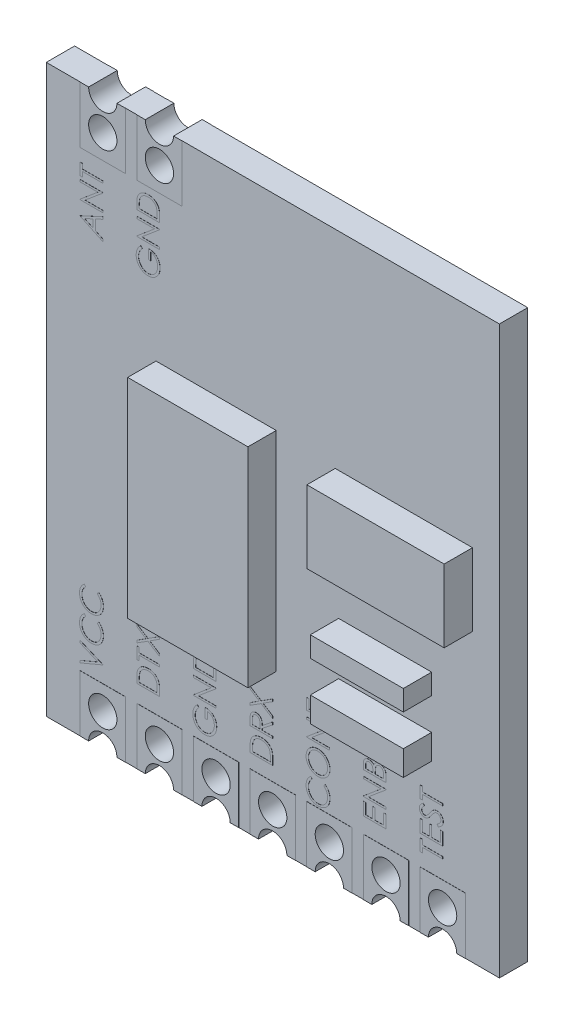
from build123d import *

# Parameters (mm, degrees)
SKIZZE1_R                       = 0.5
AUFSATZ_LINEAR_AUSTRAGEN1_DEPTH = 1
SKIZZE2_R                       = 0.5
AUFSATZ_LINEAR_AUSTRAGEN2_DEPTH = 0.005
LINEARES_MUSTER1_COUNT          = 7
LINEARES_MUSTER1_PITCH          = 2
SKIZZE3_R                       = 0.5
AUFSATZ_LINEAR_AUSTRAGEN3_DEPTH = 0.005
SPIEGELN1_COPY_1_SKETCH_R       = 0.5
SPIEGELN1_COPY_1_DEPTH          = 0.005
SPIEGELN1_COPY_2_SKETCH_R       = 0.5
SPIEGELN1_COPY_2_DEPTH          = 0.005
SPIEGELN1_COPY_3_SKETCH_R       = 0.5
SPIEGELN1_COPY_3_DEPTH          = 0.005
SPIEGELN1_COPY_4_SKETCH_R       = 0.5
SPIEGELN1_COPY_4_DEPTH          = 0.005
SPIEGELN1_COPY_5_SKETCH_R       = 0.5
SPIEGELN1_COPY_5_DEPTH          = 0.005
SPIEGELN1_COPY_6_SKETCH_R       = 0.5
SPIEGELN1_COPY_6_DEPTH          = 0.005
SKIZZE4_W                       = 4.245635115
SKIZZE4_H                       = 7.36978171
SKIZZE4_W_2                     = 4.846432538
SKIZZE4_H_2                     = 2.563402334
SKIZZE4_W_3                     = 3.284359241
SKIZZE4_H_3                     = 0.720956906
SKIZZE4_H_4                     = 0.881169552
AUFSATZ_LINEAR_AUSTRAGEN4_DEPTH = 1
AUFSATZ_LINEAR_AUSTRAGEN5_DEPTH = 0.005


with BuildPart() as part:
    # Skizze1 → Aufsatz-Linear austragen1 (new body)
    with BuildSketch(Plane.XY):
        with BuildLine():
            Line((0.5, -1.15), (1.5, -1.15))
            ThreePointArc((1.5, -1.15), (2, -0.65), (2.5, -1.15))
            Line((2.5, -1.15), (3.5, -1.15))
            ThreePointArc((3.5, -1.15), (4, -0.65), (4.5, -1.15))
            Line((4.5, -1.15), (5.5, -1.15))
            ThreePointArc((5.5, -1.15), (6, -0.65), (6.5, -1.15))
            Line((6.5, -1.15), (7.5, -1.15))
            ThreePointArc((7.5, -1.15), (8, -0.65), (8.5, -1.15))
            Line((8.5, -1.15), (9.5, -1.15))
            ThreePointArc((9.5, -1.15), (10, -0.65), (10.5, -1.15))
            Line((10.5, -1.15), (11.5, -1.15))
            ThreePointArc((11.5, -1.15), (12, -0.65), (12.5, -1.15))
            Line((12.5, -1.15), (14, -1.15))
            Line((14, -1.15), (14, 18.85))
            Line((14, 18.85), (2.5, 18.85))
            ThreePointArc((2.5, 18.85), (2, 18.35), (1.5, 18.85))
            Line((1.5, 18.85), (0.5, 18.85))
            ThreePointArc((0.5, 18.85), (0, 18.35), (-0.5, 18.85))
            Line((-0.5, 18.85), (-2, 18.85))
            Line((-2, 18.85), (-2, -1.15))
            Line((-2, -1.15), (-0.5, -1.15))
            ThreePointArc((-0.5, -1.15), (0, -0.65), (0.5, -1.15))
        make_face()
        Circle(SKIZZE1_R, mode=Mode.SUBTRACT)
        with Locations((2, 0)):
            Circle(SKIZZE1_R, mode=Mode.SUBTRACT)
        with Locations((4, 0)):
            Circle(SKIZZE1_R, mode=Mode.SUBTRACT)
        with Locations((6, 0)):
            Circle(SKIZZE1_R, mode=Mode.SUBTRACT)
        with Locations((8, 0)):
            Circle(SKIZZE1_R, mode=Mode.SUBTRACT)
        with Locations((10, 0)):
            Circle(SKIZZE1_R, mode=Mode.SUBTRACT)
        with Locations((12, 0)):
            Circle(SKIZZE1_R, mode=Mode.SUBTRACT)
        with Locations((0, 17.7)):
            Circle(SKIZZE1_R, mode=Mode.SUBTRACT)
        with Locations((2, 17.7)):
            Circle(SKIZZE1_R, mode=Mode.SUBTRACT)
    extrude(amount=AUFSATZ_LINEAR_AUSTRAGEN1_DEPTH)

    # Skizze2 → Aufsatz-Linear austragen2 (add)
    with BuildSketch(Plane.XY.offset(1)):
        with BuildLine():
            Line((0.8, 0.85), (-0.8, 0.85))
            Line((-0.8, 0.85), (-0.8, -1.15))
            Line((-0.8, -1.15), (-0.5, -1.15))
            ThreePointArc((-0.5, -1.15), (0, -0.65), (0.5, -1.15))
            Line((0.5, -1.15), (0.8, -1.15))
            Line((0.8, -1.15), (0.8, 0.85))
        make_face()
        Circle(SKIZZE2_R, mode=Mode.SUBTRACT)
    aufsatz_linear_austragen2 = extrude(amount=AUFSATZ_LINEAR_AUSTRAGEN2_DEPTH)

    # Lineares Muster1: Aufsatz-Linear austragen2 ×7
    with Locations(*[(i * LINEARES_MUSTER1_PITCH, 0, 0) for i in range(1, LINEARES_MUSTER1_COUNT)]):
        add(aufsatz_linear_austragen2)

    # Skizze3 → Aufsatz-Linear austragen3 (add)
    # profile 1 of 2: a face of its own
    with BuildSketch(Plane.XY.offset(1)):
        with BuildLine():
            Line((1.5, 18.85), (1.2, 18.85))
            Line((1.2, 18.85), (1.2, 16.85))
            Line((1.2, 16.85), (2.8, 16.85))
            Line((2.8, 16.85), (2.8, 18.85))
            Line((2.8, 18.85), (2.5, 18.85))
            ThreePointArc((2.5, 18.85), (2, 18.35), (1.5, 18.85))
        make_face()
        with Locations((2, 17.7)):
            Circle(SKIZZE3_R, mode=Mode.SUBTRACT)
    # profile 2 of 2: a face of its own
    with BuildSketch(Plane.XY.offset(1)):
        with BuildLine():
            Line((-0.8, 16.85), (0.8, 16.85))
            Line((0.8, 16.85), (0.8, 18.85))
            Line((0.8, 18.85), (0.5, 18.85))
            ThreePointArc((0.5, 18.85), (0, 18.35), (-0.5, 18.85))
            Line((-0.5, 18.85), (-0.8, 18.85))
            Line((-0.8, 18.85), (-0.8, 16.85))
        make_face()
        with Locations((0, 17.7)):
            Circle(SKIZZE3_R, mode=Mode.SUBTRACT)
    aufsatz_linear_austragen3 = extrude(amount=AUFSATZ_LINEAR_AUSTRAGEN3_DEPTH)

    # Spiegeln1: Aufsatz-Linear austragen2, Aufsatz-Linear austragen3 across plane
    add(aufsatz_linear_austragen2.mirror(Plane.XY.offset(0.5)))
    add(aufsatz_linear_austragen3.mirror(Plane.XY.offset(0.5)))

    # Spiegeln1 copy 1 sketch → Spiegeln1 copy 1 (add)
    with BuildSketch(Plane(origin=(2, 0, 0), x_dir=(1, 0, 0), z_dir=(0, 0, -1))):
        with BuildLine():
            Line((0.8, -0.85), (-0.8, -0.85))
            Line((-0.8, -0.85), (-0.8, 1.15))
            Line((-0.8, 1.15), (-0.5, 1.15))
            ThreePointArc((-0.5, 1.15), (0, 0.65), (0.5, 1.15))
            Line((0.5, 1.15), (0.8, 1.15))
            Line((0.8, 1.15), (0.8, -0.85))
        make_face()
        Circle(SPIEGELN1_COPY_1_SKETCH_R, mode=Mode.SUBTRACT)
    extrude(amount=SPIEGELN1_COPY_1_DEPTH)

    # Spiegeln1 copy 2 sketch → Spiegeln1 copy 2 (add)
    with BuildSketch(Plane(origin=(4, 0, 0), x_dir=(1, 0, 0), z_dir=(0, 0, -1))):
        with BuildLine():
            Line((0.8, -0.85), (-0.8, -0.85))
            Line((-0.8, -0.85), (-0.8, 1.15))
            Line((-0.8, 1.15), (-0.5, 1.15))
            ThreePointArc((-0.5, 1.15), (0, 0.65), (0.5, 1.15))
            Line((0.5, 1.15), (0.8, 1.15))
            Line((0.8, 1.15), (0.8, -0.85))
        make_face()
        Circle(SPIEGELN1_COPY_2_SKETCH_R, mode=Mode.SUBTRACT)
    extrude(amount=SPIEGELN1_COPY_2_DEPTH)

    # Spiegeln1 copy 3 sketch → Spiegeln1 copy 3 (add)
    with BuildSketch(Plane(origin=(6, 0, 0), x_dir=(1, 0, 0), z_dir=(0, 0, -1))):
        with BuildLine():
            Line((0.8, -0.85), (-0.8, -0.85))
            Line((-0.8, -0.85), (-0.8, 1.15))
            Line((-0.8, 1.15), (-0.5, 1.15))
            ThreePointArc((-0.5, 1.15), (0, 0.65), (0.5, 1.15))
            Line((0.5, 1.15), (0.8, 1.15))
            Line((0.8, 1.15), (0.8, -0.85))
        make_face()
        Circle(SPIEGELN1_COPY_3_SKETCH_R, mode=Mode.SUBTRACT)
    extrude(amount=SPIEGELN1_COPY_3_DEPTH)

    # Spiegeln1 copy 4 sketch → Spiegeln1 copy 4 (add)
    with BuildSketch(Plane(origin=(8, 0, 0), x_dir=(1, 0, 0), z_dir=(0, 0, -1))):
        with BuildLine():
            Line((0.8, -0.85), (-0.8, -0.85))
            Line((-0.8, -0.85), (-0.8, 1.15))
            Line((-0.8, 1.15), (-0.5, 1.15))
            ThreePointArc((-0.5, 1.15), (0, 0.65), (0.5, 1.15))
            Line((0.5, 1.15), (0.8, 1.15))
            Line((0.8, 1.15), (0.8, -0.85))
        make_face()
        Circle(SPIEGELN1_COPY_4_SKETCH_R, mode=Mode.SUBTRACT)
    extrude(amount=SPIEGELN1_COPY_4_DEPTH)

    # Spiegeln1 copy 5 sketch → Spiegeln1 copy 5 (add)
    with BuildSketch(Plane(origin=(10, 0, 0), x_dir=(1, 0, 0), z_dir=(0, 0, -1))):
        with BuildLine():
            Line((0.8, -0.85), (-0.8, -0.85))
            Line((-0.8, -0.85), (-0.8, 1.15))
            Line((-0.8, 1.15), (-0.5, 1.15))
            ThreePointArc((-0.5, 1.15), (0, 0.65), (0.5, 1.15))
            Line((0.5, 1.15), (0.8, 1.15))
            Line((0.8, 1.15), (0.8, -0.85))
        make_face()
        Circle(SPIEGELN1_COPY_5_SKETCH_R, mode=Mode.SUBTRACT)
    extrude(amount=SPIEGELN1_COPY_5_DEPTH)

    # Spiegeln1 copy 6 sketch → Spiegeln1 copy 6 (add)
    with BuildSketch(Plane(origin=(12, 0, 0), x_dir=(1, 0, 0), z_dir=(0, 0, -1))):
        with BuildLine():
            Line((0.8, -0.85), (-0.8, -0.85))
            Line((-0.8, -0.85), (-0.8, 1.15))
            Line((-0.8, 1.15), (-0.5, 1.15))
            ThreePointArc((-0.5, 1.15), (0, 0.65), (0.5, 1.15))
            Line((0.5, 1.15), (0.8, 1.15))
            Line((0.8, 1.15), (0.8, -0.85))
        make_face()
        Circle(SPIEGELN1_COPY_6_SKETCH_R, mode=Mode.SUBTRACT)
    extrude(amount=SPIEGELN1_COPY_6_DEPTH)

    # Skizze4 → Aufsatz-Linear austragen4 (add)
    with BuildSketch(Plane.XY.offset(1)):
        with Locations((3.997341927, 7.968830448)):
            Rectangle(SKIZZE4_W, SKIZZE4_H)
        with Locations((10.62614015, 10.251860651)):
            Rectangle(SKIZZE4_W_2, SKIZZE4_H_2)
        with Locations((9.965262986, 6.647076119)):
            Rectangle(SKIZZE4_W_3, SKIZZE4_H_3)
        with Locations((9.965262986, 4.724524369)):
            Rectangle(SKIZZE4_W_3, SKIZZE4_H_4)
    extrude(amount=AUFSATZ_LINEAR_AUSTRAGEN4_DEPTH)

    # Skizze5 → Aufsatz-Linear austragen5 (add)
    # profile 1 of 29: a face of its own
    with BuildSketch(Plane.XY.offset(1)):
        Polygon((-0.8, 1.08742277), (-0.8, 1.164345847), (-0.169551282, 1.431012513), (-0.8, 1.69767918), (-0.8, 1.774602257), (0, 1.436140719), (0, 1.425884308), align=None)
    # profile 2 of 29: a face of its own
    with BuildSketch(Plane.XY.offset(1)):
        with BuildLine():
            Line((-0.653205128, 2.666909949), (-0.605128205, 2.604089437))
            add(Edge.make_bspline(
                [(-0.605128205, 2.604089437), (-0.610468928, 2.599608045), (-0.621078368, 2.59070568), (-0.635977588, 2.576384252), (-0.649931478, 2.561455636), (-0.663029696, 2.545940605), (-0.674745796, 2.529480104), (-0.685992237, 2.512701324), (-0.695838884, 2.49499462), (-0.707867794, 2.470633965), (-0.720146273, 2.438641815), (-0.730706824, 2.398508137), (-0.737366064, 2.356554807), (-0.738092198, 2.327939306), (-0.738461538, 2.313384308)],
                knots=[0, 0, 0, 0, 0.75789156, 1.505565099, 2.245254514, 2.979266606, 3.711207489, 4.440978832, 5.174393176, 5.91211879, 7.394186119, 8.890401545, 10.418332761, 12, 12, 12, 12], degree=3))
            add(Edge.make_bspline(
                [(-0.738461538, 2.313384308), (-0.738369204, 2.305365268), (-0.738185393, 2.289401613), (-0.73576045, 2.265710533), (-0.732352173, 2.242461836), (-0.727294956, 2.219670644), (-0.720901215, 2.197365967), (-0.71326112, 2.175401991), (-0.703808588, 2.154096707), (-0.693360975, 2.133155409), (-0.681560455, 2.113091538), (-0.668688692, 2.094107715), (-0.654890549, 2.076272067), (-0.640111288, 2.059574552), (-0.624428579, 2.043983126), (-0.607666723, 2.029693982), (-0.59000491, 2.016516207), (-0.571428473, 2.004524904), (-0.552110422, 1.993729946), (-0.531940463, 1.984653065), (-0.511263947, 1.976725379), (-0.489934291, 1.970353576), (-0.468093264, 1.965349363), (-0.445650384, 1.96188968), (-0.422648201, 1.95949284), (-0.407057528, 1.959309871), (-0.399198718, 1.959217642)],
                knots=[0, 0, 0, 0, 1.054877232, 2.099964208, 3.13098259, 4.145888998, 5.169474743, 6.183358035, 7.203388855, 8.234598956, 9.261847606, 10.264062591, 11.251197969, 12.227332808, 13.196685059, 14.158975844, 15.123498106, 16.094582253, 17.066912473, 18.032714859, 19.002806091, 19.979168736, 20.95977404, 21.949109834, 22.966205168, 24, 24, 24, 24], degree=3))
            add(Edge.make_bspline(
                [(-0.399198718, 1.959217642), (-0.38737468, 1.959506734), (-0.364159749, 1.960074328), (-0.330151297, 1.965104347), (-0.2975399, 1.97280935), (-0.26654637, 1.984167988), (-0.236912336, 1.998453278), (-0.208997172, 2.01627738), (-0.182391913, 2.036998944), (-0.157740922, 2.060830548), (-0.135223818, 2.08698114), (-0.115395029, 2.115037622), (-0.098865935, 2.144931222), (-0.085111427, 2.176331582), (-0.074538463, 2.209480411), (-0.067095234, 2.244318079), (-0.062239879, 2.280768821), (-0.061775036, 2.305676113), (-0.061538462, 2.318352257)],
                knots=[0, 0, 0, 0, 1.029159485, 2.020618137, 2.987588728, 3.942669054, 4.889339625, 5.846988364, 6.821327795, 7.821533711, 8.827683044, 9.822769455, 10.807800696, 11.797391277, 12.803701919, 13.832062008, 14.896664671, 16, 16, 16, 16], degree=3))
            add(Edge.make_bspline(
                [(-0.061538462, 2.318352257), (-0.061924468, 2.332318586), (-0.062684222, 2.359807662), (-0.069120622, 2.400120354), (-0.079556717, 2.438711386), (-0.094161957, 2.475582834), (-0.113148308, 2.510630754), (-0.136164966, 2.54390999), (-0.163430871, 2.575448635), (-0.184249871, 2.594413499), (-0.194871795, 2.604089437)],
                knots=[0, 0, 0, 0, 1.028121516, 2.023589091, 2.998037872, 3.967518031, 4.937445131, 5.927275754, 6.942489185, 8, 8, 8, 8], degree=3))
            Line((-0.194871795, 2.604089437), (-0.147275641, 2.666909949))
            add(Edge.make_bspline(
                [(-0.147275641, 2.666909949), (-0.140752792, 2.661854204), (-0.127738338, 2.65176693), (-0.109387171, 2.635436298), (-0.092141613, 2.618220238), (-0.076087789, 2.600074495), (-0.061159249, 2.580967089), (-0.047347884, 2.560899771), (-0.034726991, 2.539889672), (-0.02313408, 2.518103672), (-0.012926916, 2.49549157), (-0.003881877, 2.47225243), (0.003606415, 2.448243762), (0.009940671, 2.423667668), (0.01445728, 2.398302189), (0.018053954, 2.372442181), (0.020187767, 2.345845603), (0.020403497, 2.327917994), (0.020512821, 2.318833026)],
                knots=[0, 0, 0, 0, 0.986911346, 1.969095443, 2.935967484, 3.900112155, 4.865124501, 5.834589912, 6.812044781, 7.795288262, 8.784678562, 9.777857908, 10.776141921, 11.791195789, 12.811324908, 13.855933174, 14.913475973, 16, 16, 16, 16], degree=3))
            add(Edge.make_bspline(
                [(0.020512821, 2.318833026), (0.020452937, 2.310228759), (0.020334523, 2.293214887), (0.018416314, 2.268095173), (0.015799231, 2.243640411), (0.011858629, 2.219920497), (0.007208495, 2.196805988), (0.000975065, 2.174506426), (-0.006007602, 2.152802378), (-0.014214456, 2.131781043), (-0.023475298, 2.11142454), (-0.03394194, 2.091798526), (-0.045526366, 2.072912027), (-0.057973226, 2.05457936), (-0.071682323, 2.037071341), (-0.086463268, 2.020236249), (-0.102266242, 2.003979683), (-0.113661637, 1.993921927), (-0.119391026, 1.988865078)],
                knots=[0, 0, 0, 0, 1.114604814, 2.203992996, 3.262667896, 4.300477797, 5.318619304, 6.316056647, 7.298880507, 8.271930387, 9.238335007, 10.195173496, 11.151986948, 12.108099108, 13.064862484, 14.031167946, 15.010108607, 16, 16, 16, 16], degree=3))
            add(Edge.make_bspline(
                [(-0.119391026, 1.988865078), (-0.129343503, 1.98076603), (-0.149128302, 1.964665714), (-0.181190646, 1.94405778), (-0.214636641, 1.926476314), (-0.249660012, 1.912102367), (-0.286274374, 1.901061499), (-0.324420826, 1.893299051), (-0.36402311, 1.888289955), (-0.390956853, 1.887715015), (-0.404647436, 1.88742277)],
                knots=[0, 0, 0, 0, 0.994611881, 1.977215934, 2.950189954, 3.921972279, 4.908960509, 5.911694611, 6.938501887, 8, 8, 8, 8], degree=3))
            add(Edge.make_bspline(
                [(-0.404647436, 1.88742277), (-0.419037254, 1.887778243), (-0.447348322, 1.888477613), (-0.488896655, 1.894419509), (-0.528702689, 1.903978091), (-0.566692116, 1.917554523), (-0.603064751, 1.934767175), (-0.637542741, 1.956030401), (-0.670346581, 1.981097176), (-0.700978524, 2.009770906), (-0.728987519, 2.041214868), (-0.753628937, 2.07488774), (-0.774135798, 2.110723614), (-0.791277778, 2.148327694), (-0.804453655, 2.187981564), (-0.813677241, 2.22960062), (-0.819418296, 2.273106657), (-0.820144058, 2.302789498), (-0.820512821, 2.317871488)],
                knots=[0, 0, 0, 0, 1.032925535, 2.032216505, 3.007276963, 3.968222605, 4.92396291, 5.891752235, 6.871517503, 7.883894988, 8.900124299, 9.891468569, 10.874487609, 11.85992873, 12.854644235, 13.869047385, 14.917252991, 16, 16, 16, 16], degree=3))
            add(Edge.make_bspline(
                [(-0.820512821, 2.317871488), (-0.820402522, 2.327063337), (-0.820184196, 2.345257677), (-0.818058467, 2.372173006), (-0.814507393, 2.398375359), (-0.809699471, 2.423892295), (-0.803644863, 2.448797584), (-0.796098883, 2.473044631), (-0.787114863, 2.496574064), (-0.776855529, 2.519378236), (-0.765318966, 2.541303209), (-0.752641253, 2.562335217), (-0.738886445, 2.582390412), (-0.723913725, 2.601364555), (-0.707847289, 2.619280861), (-0.690875335, 2.636405101), (-0.672562347, 2.652238807), (-0.659669346, 2.662010616), (-0.653205128, 2.666909949)],
                knots=[0, 0, 0, 0, 1.096622143, 2.170653093, 3.219033441, 4.250379162, 5.267604342, 6.275621678, 7.278284436, 8.271072515, 9.257558938, 10.232633088, 11.19973724, 12.157384997, 13.114417402, 14.069920322, 15.032307892, 16, 16, 16, 16], degree=3))
        make_face()
    # profile 3 of 29: a face of its own
    with BuildSketch(Plane.XY.offset(1)):
        with BuildLine():
            Line((-0.653205128, 3.569474052), (-0.605128205, 3.506653539))
            add(Edge.make_bspline(
                [(-0.605128205, 3.506653539), (-0.610468928, 3.502172147), (-0.621078368, 3.493269782), (-0.635977588, 3.478948354), (-0.649931478, 3.464019739), (-0.663029696, 3.448504707), (-0.674745796, 3.432044206), (-0.685992237, 3.415265427), (-0.695838884, 3.397558722), (-0.707867794, 3.373198068), (-0.720146273, 3.341205917), (-0.730706824, 3.301072239), (-0.737366064, 3.259118909), (-0.738092198, 3.230503409), (-0.738461538, 3.215948411)],
                knots=[0, 0, 0, 0, 0.75789156, 1.505565099, 2.245254514, 2.979266606, 3.711207489, 4.440978832, 5.174393176, 5.91211879, 7.394186119, 8.890401545, 10.418332761, 12, 12, 12, 12], degree=3))
            add(Edge.make_bspline(
                [(-0.738461538, 3.215948411), (-0.738369204, 3.207929371), (-0.738185393, 3.191965716), (-0.73576045, 3.168274636), (-0.732352173, 3.145025939), (-0.727294956, 3.122234746), (-0.720901215, 3.09993007), (-0.71326112, 3.077966093), (-0.703808588, 3.056660809), (-0.693360975, 3.035719512), (-0.681560455, 3.01565564), (-0.668688692, 2.996671817), (-0.654890549, 2.978836169), (-0.640111288, 2.962138655), (-0.624428579, 2.946547228), (-0.607666723, 2.932258085), (-0.59000491, 2.91908031), (-0.571428473, 2.907089006), (-0.552110422, 2.896294049), (-0.531940463, 2.887217168), (-0.511263947, 2.879289482), (-0.489934291, 2.872917679), (-0.468093264, 2.867913465), (-0.445650384, 2.864453782), (-0.422648201, 2.862056943), (-0.407057528, 2.861873974), (-0.399198718, 2.861781744)],
                knots=[0, 0, 0, 0, 1.054877232, 2.099964208, 3.13098259, 4.145888998, 5.169474743, 6.183358035, 7.203388855, 8.234598956, 9.261847606, 10.264062591, 11.251197969, 12.227332808, 13.196685059, 14.158975844, 15.123498106, 16.094582253, 17.066912473, 18.032714859, 19.002806091, 19.979168736, 20.95977404, 21.949109834, 22.966205168, 24, 24, 24, 24], degree=3))
            add(Edge.make_bspline(
                [(-0.399198718, 2.861781744), (-0.38737468, 2.862070836), (-0.364159749, 2.86263843), (-0.330151297, 2.867668449), (-0.2975399, 2.875373453), (-0.26654637, 2.886732091), (-0.236912336, 2.90101738), (-0.208997172, 2.918841482), (-0.182391913, 2.939563047), (-0.157740922, 2.96339465), (-0.135223818, 2.989545243), (-0.115395029, 3.017601725), (-0.098865935, 3.047495325), (-0.085111427, 3.078895684), (-0.074538463, 3.112044514), (-0.067095234, 3.146882182), (-0.062239879, 3.183332924), (-0.061775036, 3.208240215), (-0.061538462, 3.22091636)],
                knots=[0, 0, 0, 0, 1.029159485, 2.020618137, 2.987588728, 3.942669054, 4.889339625, 5.846988364, 6.821327795, 7.821533711, 8.827683044, 9.822769455, 10.807800696, 11.797391277, 12.803701919, 13.832062008, 14.896664671, 16, 16, 16, 16], degree=3))
            add(Edge.make_bspline(
                [(-0.061538462, 3.22091636), (-0.061924468, 3.234882688), (-0.062684222, 3.262371765), (-0.069120622, 3.302684457), (-0.079556717, 3.341275489), (-0.094161957, 3.378146937), (-0.113148308, 3.413194856), (-0.136164966, 3.446474093), (-0.163430871, 3.478012738), (-0.184249871, 3.496977602), (-0.194871795, 3.506653539)],
                knots=[0, 0, 0, 0, 1.028121516, 2.023589091, 2.998037872, 3.967518031, 4.937445131, 5.927275754, 6.942489185, 8, 8, 8, 8], degree=3))
            Line((-0.194871795, 3.506653539), (-0.147275641, 3.569474052))
            add(Edge.make_bspline(
                [(-0.147275641, 3.569474052), (-0.140752792, 3.564418307), (-0.127738338, 3.554331033), (-0.109387171, 3.538000401), (-0.092141613, 3.52078434), (-0.076087789, 3.502638598), (-0.061159249, 3.483531191), (-0.047347884, 3.463463874), (-0.034726991, 3.442453775), (-0.02313408, 3.420667775), (-0.012926916, 3.398055673), (-0.003881877, 3.374816532), (0.003606415, 3.350807865), (0.009940671, 3.326231771), (0.01445728, 3.300866292), (0.018053954, 3.275006284), (0.020187767, 3.248409706), (0.020403497, 3.230482097), (0.020512821, 3.221397129)],
                knots=[0, 0, 0, 0, 0.986911346, 1.969095443, 2.935967484, 3.900112155, 4.865124501, 5.834589912, 6.812044781, 7.795288262, 8.784678562, 9.777857908, 10.776141921, 11.791195789, 12.811324908, 13.855933174, 14.913475973, 16, 16, 16, 16], degree=3))
            add(Edge.make_bspline(
                [(0.020512821, 3.221397129), (0.020452937, 3.212792862), (0.020334523, 3.19577899), (0.018416314, 3.170659275), (0.015799231, 3.146204514), (0.011858629, 3.1224846), (0.007208495, 3.099370091), (0.000975065, 3.077070529), (-0.006007602, 3.055366481), (-0.014214456, 3.034345146), (-0.023475298, 3.013988643), (-0.03394194, 2.994362629), (-0.045526366, 2.97547613), (-0.057973226, 2.957143462), (-0.071682323, 2.939635443), (-0.086463268, 2.922800352), (-0.102266242, 2.906543786), (-0.113661637, 2.896486029), (-0.119391026, 2.89142918)],
                knots=[0, 0, 0, 0, 1.114604814, 2.203992996, 3.262667896, 4.300477797, 5.318619304, 6.316056647, 7.298880507, 8.271930387, 9.238335007, 10.195173496, 11.151986948, 12.108099108, 13.064862484, 14.031167946, 15.010108607, 16, 16, 16, 16], degree=3))
            add(Edge.make_bspline(
                [(-0.119391026, 2.89142918), (-0.129343503, 2.883330133), (-0.149128302, 2.867229817), (-0.181190646, 2.846621882), (-0.214636641, 2.829040416), (-0.249660012, 2.81466647), (-0.286274374, 2.803625602), (-0.324420826, 2.795863154), (-0.36402311, 2.790854058), (-0.390956853, 2.790279118), (-0.404647436, 2.789986872)],
                knots=[0, 0, 0, 0, 0.994611881, 1.977215934, 2.950189954, 3.921972279, 4.908960509, 5.911694611, 6.938501887, 8, 8, 8, 8], degree=3))
            add(Edge.make_bspline(
                [(-0.404647436, 2.789986872), (-0.419037254, 2.790342345), (-0.447348322, 2.791041716), (-0.488896655, 2.796983612), (-0.528702689, 2.806542194), (-0.566692116, 2.820118626), (-0.603064751, 2.837331277), (-0.637542741, 2.858594503), (-0.670346581, 2.883661279), (-0.700978524, 2.912335008), (-0.728987519, 2.943778971), (-0.753628937, 2.977451843), (-0.774135798, 3.013287716), (-0.791277778, 3.050891797), (-0.804453655, 3.090545667), (-0.813677241, 3.132164722), (-0.819418296, 3.17567076), (-0.820144058, 3.2053536), (-0.820512821, 3.22043559)],
                knots=[0, 0, 0, 0, 1.032925535, 2.032216505, 3.007276963, 3.968222605, 4.92396291, 5.891752235, 6.871517503, 7.883894988, 8.900124299, 9.891468569, 10.874487609, 11.85992873, 12.854644235, 13.869047385, 14.917252991, 16, 16, 16, 16], degree=3))
            add(Edge.make_bspline(
                [(-0.820512821, 3.22043559), (-0.820402522, 3.22962744), (-0.820184196, 3.247821779), (-0.818058467, 3.274737108), (-0.814507393, 3.300939462), (-0.809699471, 3.326456397), (-0.803644863, 3.351361686), (-0.796098883, 3.375608734), (-0.787114863, 3.399138166), (-0.776855529, 3.421942339), (-0.765318966, 3.443867312), (-0.752641253, 3.46489932), (-0.738886445, 3.484954514), (-0.723913725, 3.503928657), (-0.707847289, 3.521844963), (-0.690875335, 3.538969204), (-0.672562347, 3.554802909), (-0.659669346, 3.564574719), (-0.653205128, 3.569474052)],
                knots=[0, 0, 0, 0, 1.096622143, 2.170653093, 3.219033441, 4.250379162, 5.267604342, 6.275621678, 7.278284436, 8.271072515, 9.257558938, 10.232633088, 11.19973724, 12.157384997, 13.114417402, 14.069920322, 15.032307892, 16, 16, 16, 16], degree=3))
        make_face()
    # profile 4 of 29: a face of its own
    with BuildSketch(Plane.XY.offset(1)):
        with BuildLine():
            Line((2, 1.461781744), (1.2, 1.461781744))
            Line((1.2, 1.461781744), (1.2, 1.623320206))
            add(Edge.make_bspline(
                [(1.2, 1.623320206), (1.200101159, 1.63737026), (1.200296597, 1.664514892), (1.201535772, 1.703740595), (1.203727879, 1.740034026), (1.206920913, 1.773275822), (1.210841607, 1.803557242), (1.215755985, 1.830793495), (1.221558995, 1.855125414), (1.226506527, 1.870089857), (1.228846154, 1.87716636)],
                knots=[0, 0, 0, 0, 1.314313732, 2.53924729, 3.670748893, 4.714932338, 5.66265055, 6.526160246, 7.303039223, 8, 8, 8, 8], degree=3))
            add(Edge.make_bspline(
                [(1.228846154, 1.87716636), (1.232372074, 1.886423134), (1.239343958, 1.904726769), (1.252515629, 1.930773438), (1.267378406, 1.955377025), (1.284274323, 1.978341368), (1.302982747, 1.999724087), (1.323370026, 2.019767869), (1.345889054, 2.037978535), (1.370139006, 2.054639717), (1.395809171, 2.069665988), (1.42285751, 2.082726103), (1.451144786, 2.093572801), (1.480592843, 2.102576948), (1.511266295, 2.109673286), (1.543200894, 2.114514869), (1.576270423, 2.117708239), (1.598710301, 2.118029165), (1.610096154, 2.118192001)],
                knots=[0, 0, 0, 0, 0.984741985, 1.947153288, 2.898543998, 3.841229145, 4.778974371, 5.722123648, 6.681464302, 7.655713756, 8.646344578, 9.637374342, 10.639946623, 11.656849581, 12.698333139, 13.76849723, 14.867749466, 16, 16, 16, 16], degree=3))
            add(Edge.make_bspline(
                [(1.610096154, 2.118192001), (1.619984437, 2.118048237), (1.639470331, 2.117764934), (1.668188252, 2.115221092), (1.696054206, 2.111523642), (1.722935526, 2.105799275), (1.749067628, 2.098850052), (1.774172369, 2.089944242), (1.79847869, 2.079740812), (1.821662899, 2.067847486), (1.843613653, 2.054772834), (1.864321669, 2.040829109), (1.883327429, 2.02570008), (1.901128971, 2.009833519), (1.917250747, 1.992846807), (1.931986634, 1.974946754), (1.945089923, 1.956063795), (1.956766518, 1.936081041), (1.967208574, 1.914731616), (1.975918502, 1.891343973), (1.983462188, 1.866028894), (1.989463191, 1.838642014), (1.994303043, 1.809281014), (1.997525435, 1.777864445), (1.999710826, 1.74445168), (1.999901737, 1.721507769), (2, 1.709698411)],
                knots=[0, 0, 0, 0, 1.106010661, 2.179509527, 3.223302912, 4.248870533, 5.252098245, 6.246278179, 7.226402005, 8.199283979, 9.158616973, 10.083547221, 10.989831858, 11.874256832, 12.749262829, 13.607058236, 14.46581075, 15.317568432, 16.194266721, 17.121067875, 18.106207572, 19.147242834, 20.255495536, 21.43354536, 22.679031616, 24, 24, 24, 24], degree=3))
            Line((2, 1.709698411), (2, 1.461781744))
        make_face()
        with BuildLine():
            Line((1.917948718, 1.533576616), (1.917948718, 1.625403539))
            add(Edge.make_bspline(
                [(1.917948718, 1.625403539), (1.91789201, 1.638598595), (1.91778294, 1.663977521), (1.916825865, 1.700470777), (1.915261994, 1.733814639), (1.913073405, 1.764013841), (1.910177721, 1.791051333), (1.906949172, 1.814983618), (1.902926898, 1.835732249), (1.899280964, 1.848287549), (1.897596154, 1.854089437)],
                knots=[0, 0, 0, 0, 1.375205317, 2.645023457, 3.804390687, 4.853969522, 5.800190428, 6.637939096, 7.370582563, 8, 8, 8, 8], degree=3))
            add(Edge.make_bspline(
                [(1.897596154, 1.854089437), (1.89502437, 1.86139192), (1.889942228, 1.875822467), (1.880671899, 1.896595276), (1.86969088, 1.915968346), (1.857484552, 1.934279061), (1.843622958, 1.951268563), (1.828405421, 1.967134859), (1.811762417, 1.981858523), (1.793720933, 1.995212771), (1.774476606, 2.007308647), (1.753995403, 2.017692449), (1.732565257, 2.02673538), (1.71001268, 2.033895744), (1.686502969, 2.039541377), (1.661914217, 2.043498651), (1.636268183, 2.045955386), (1.618809029, 2.046248276), (1.609935897, 2.046397129)],
                knots=[0, 0, 0, 0, 0.998590647, 1.973329978, 2.929871262, 3.868367705, 4.809062953, 5.754642869, 6.701828697, 7.672172887, 8.647399344, 9.630604387, 10.631475358, 11.644913558, 12.679592956, 13.747988925, 14.855477812, 16, 16, 16, 16], degree=3))
            add(Edge.make_bspline(
                [(1.609935897, 2.046397129), (1.600579673, 2.046279806), (1.582199288, 2.046049324), (1.555229987, 2.043152339), (1.529291552, 2.038918841), (1.50438225, 2.032796855), (1.480453484, 2.024995512), (1.457637596, 2.015259593), (1.435693626, 2.004135795), (1.415128057, 1.990900746), (1.395678203, 1.976405754), (1.377859937, 1.960319381), (1.361632668, 1.942897201), (1.346743682, 1.924329235), (1.333791985, 1.904092184), (1.322206458, 1.882662769), (1.312374254, 1.859726616), (1.3071448, 1.843769428), (1.304487179, 1.835659949)],
                knots=[0, 0, 0, 0, 1.122418816, 2.205001699, 3.251619955, 4.274784885, 5.280384055, 6.268708349, 7.249350384, 8.229342522, 9.199999885, 10.157847722, 11.105861043, 12.055065948, 13.010012805, 13.98527497, 14.976112212, 16, 16, 16, 16], degree=3))
            add(Edge.make_bspline(
                [(1.304487179, 1.835659949), (1.302631996, 1.828951116), (1.298687367, 1.814686295), (1.294384425, 1.791408703), (1.29058911, 1.765210955), (1.287375844, 1.735976738), (1.285070171, 1.703739376), (1.283339585, 1.668474075), (1.282172354, 1.630165594), (1.28209265, 1.603609587), (1.282051282, 1.589826616)],
                knots=[0, 0, 0, 0, 0.674548936, 1.434276114, 2.292660221, 3.240891867, 4.284742987, 5.42552168, 6.663806718, 8, 8, 8, 8], degree=3))
            Line((1.282051282, 1.589826616), (1.282051282, 1.533576616))
            Line((1.282051282, 1.533576616), (1.917948718, 1.533576616))
        make_face(mode=Mode.SUBTRACT)
    # profile 5 of 29: a face of its own
    with BuildSketch(Plane.XY.offset(1)):
        Polygon((1.282051282, 2.189986872), (1.2, 2.189986872), (1.2, 2.610499693), (1.282051282, 2.610499693), (1.282051282, 2.436140719), (2, 2.436140719), (2, 2.364345847), (1.282051282, 2.364345847), align=None)
    # profile 6 of 29: a face of its own
    with BuildSketch(Plane.XY.offset(1)):
        Polygon((1.2, 2.69767918), (1.2, 2.780531744), (1.52724359, 2.989986872), (1.2, 3.199442001), (1.2, 3.282294565), (1.591987179, 3.031493283), (2, 3.292550975), (2, 3.209698411), (1.656730769, 2.989986872), (2, 2.770275334), (2, 2.68742277), (1.591987179, 2.948640719), align=None)
    # profile 7 of 29: a face of its own
    with BuildSketch(Plane.XY.offset(1)):
        with BuildLine():
            Line((3.336538462, 1.882294565), (3.394871795, 1.820756103))
            add(Edge.make_bspline(
                [(3.394871795, 1.820756103), (3.384392658, 1.809622599), (3.363684266, 1.787621076), (3.336858497, 1.75168966), (3.313650971, 1.714351179), (3.294909122, 1.67554526), (3.280207028, 1.636289488), (3.26951995, 1.59725887), (3.262751914, 1.558706116), (3.261939018, 1.533068561), (3.261538462, 1.52043559)],
                knots=[0, 0, 0, 0, 1.089067066, 2.152164705, 3.18986567, 4.218445106, 5.218487318, 6.173592265, 7.100032889, 8, 8, 8, 8], degree=3))
            add(Edge.make_bspline(
                [(3.261538462, 1.52043559), (3.261633, 1.512683659), (3.261821832, 1.497199901), (3.264231938, 1.4742006), (3.267698193, 1.451442511), (3.272713479, 1.428968597), (3.279069835, 1.40673516), (3.287020799, 1.384819528), (3.296290567, 1.363180815), (3.307002, 1.342022868), (3.318768783, 1.3215107), (3.331808591, 1.302137901), (3.345702654, 1.283779852), (3.360801917, 1.266785748), (3.376958329, 1.251042545), (3.393880927, 1.23626067), (3.411902429, 1.222715624), (3.430948727, 1.210650335), (3.450576716, 1.199754885), (3.470619933, 1.190339525), (3.49089231, 1.182154392), (3.511546496, 1.175920344), (3.532369555, 1.170640144), (3.553470609, 1.166964433), (3.574904761, 1.164885275), (3.589258521, 1.164526306), (3.596474359, 1.164345847)],
                knots=[0, 0, 0, 0, 1.028150113, 2.053633673, 3.06513288, 4.081487945, 5.106702018, 6.131327874, 7.172780699, 8.228344599, 9.276313556, 10.308389736, 11.324843658, 12.329040066, 13.321460474, 14.316307835, 15.308626991, 16.309440696, 17.305625405, 18.28535951, 19.246194545, 20.203493668, 21.145557131, 22.095268976, 23.042464743, 24, 24, 24, 24], degree=3))
            add(Edge.make_bspline(
                [(3.596474359, 1.164345847), (3.60385051, 1.164518691), (3.618582671, 1.164863909), (3.64057042, 1.167070354), (3.662229067, 1.171174402), (3.683592679, 1.176617087), (3.704703773, 1.183536556), (3.725540318, 1.192037702), (3.746100288, 1.202164818), (3.766179583, 1.213861108), (3.78572247, 1.226777558), (3.804285323, 1.240983543), (3.821652115, 1.25650298), (3.838076514, 1.27305131), (3.853454863, 1.290779309), (3.867601801, 1.309858973), (3.880736082, 1.330023223), (3.892713416, 1.351281003), (3.903412242, 1.373407627), (3.912926347, 1.396094811), (3.920761605, 1.419415475), (3.927147463, 1.443246941), (3.932381815, 1.467560833), (3.93574924, 1.492480559), (3.938192858, 1.517822893), (3.938371525, 1.534906009), (3.938461538, 1.543512513)],
                knots=[0, 0, 0, 0, 0.935915162, 1.869274651, 2.799799983, 3.730201895, 4.664668062, 5.616159355, 6.583070886, 7.570012957, 8.562524459, 9.553461134, 10.53281078, 11.515274572, 12.509912756, 13.507571325, 14.526460018, 15.561318395, 16.601025881, 17.643204557, 18.680545676, 19.719612342, 20.772381578, 21.833430283, 22.908478249, 24, 24, 24, 24], degree=3))
            add(Edge.make_bspline(
                [(3.938461538, 1.543512513), (3.938244811, 1.553884749), (3.937819231, 1.57425232), (3.934503603, 1.604191479), (3.929331839, 1.632948648), (3.921734341, 1.660430211), (3.912117782, 1.686735902), (3.900225535, 1.711768699), (3.886182727, 1.735597726), (3.870273723, 1.758119843), (3.852548359, 1.778799619), (3.833591854, 1.797620665), (3.813158613, 1.813935779), (3.791553162, 1.828232309), (3.76856884, 1.840048822), (3.744333511, 1.849750737), (3.71883218, 1.857186727), (3.701211261, 1.860239318), (3.692307692, 1.861781744)],
                knots=[0, 0, 0, 0, 1.130199668, 2.219330667, 3.279027493, 4.311506524, 5.322739849, 6.327972234, 7.327472899, 8.33386792, 9.329086447, 10.29244429, 11.240784345, 12.174119183, 13.111530729, 14.052100829, 15.015757696, 16, 16, 16, 16], degree=3))
            Line((3.692307692, 1.861781744), (3.692307692, 1.595115078))
            Line((3.692307692, 1.595115078), (3.61025641, 1.595115078))
            Line((3.61025641, 1.595115078), (3.61025641, 1.933576616))
            add(Edge.make_bspline(
                [(3.61025641, 1.933576616), (3.625549551, 1.933186708), (3.655480989, 1.932423587), (3.699131336, 1.927070692), (3.740359152, 1.918426918), (3.779207854, 1.906618846), (3.815622389, 1.891333068), (3.84963973, 1.872733633), (3.881040115, 1.850522863), (3.910079887, 1.825491904), (3.935983707, 1.797400486), (3.958750778, 1.767007658), (3.977928519, 1.734263208), (3.993530956, 1.699198109), (4.005707869, 1.661927153), (4.014341372, 1.622364095), (4.019513935, 1.580562586), (4.020174822, 1.551914203), (4.020512821, 1.537262513)],
                knots=[0, 0, 0, 0, 1.140356446, 2.231883559, 3.274166699, 4.278491846, 5.25512956, 6.21435461, 7.1637429, 8.11826594, 9.068280886, 10.0076534, 10.945064095, 11.891975133, 12.864533718, 13.863980011, 14.907571808, 16, 16, 16, 16], degree=3))
            add(Edge.make_bspline(
                [(4.020512821, 1.537262513), (4.020382736, 1.528231625), (4.020126166, 1.510419803), (4.018302773, 1.484113306), (4.015495784, 1.458532135), (4.011256898, 1.433680019), (4.006064978, 1.409465541), (3.999416585, 1.386009636), (3.991720882, 1.363222952), (3.982967585, 1.341070269), (3.972825492, 1.319752659), (3.961554717, 1.299175169), (3.949213378, 1.279224054), (3.935588042, 1.260035217), (3.920780622, 1.241508675), (3.904761441, 1.223763888), (3.887579471, 1.206701515), (3.875378554, 1.19601341), (3.869230769, 1.190627898)],
                knots=[0, 0, 0, 0, 1.107784379, 2.184907829, 3.233506516, 4.263428166, 5.276301166, 6.270063455, 7.25232949, 8.225834625, 9.190232166, 10.146266622, 11.1027726, 12.066435141, 13.031522626, 14.010570082, 14.99756817, 16, 16, 16, 16], degree=3))
            add(Edge.make_bspline(
                [(3.869230769, 1.190627898), (3.859477477, 1.182813971), (3.840132787, 1.167315819), (3.809138514, 1.147366526), (3.777046661, 1.130360491), (3.743767889, 1.116562132), (3.709333326, 1.105787712), (3.673786973, 1.098060569), (3.637083058, 1.093533188), (3.612245283, 1.092880951), (3.599679487, 1.092550975)],
                knots=[0, 0, 0, 0, 1.023165419, 2.029347347, 3.013907458, 3.994755782, 4.975994455, 5.96558838, 6.970761222, 8, 8, 8, 8], degree=3))
            add(Edge.make_bspline(
                [(3.599679487, 1.092550975), (3.590270058, 1.092672629), (3.571570788, 1.092914392), (3.543809118, 1.095845939), (3.516540387, 1.100051976), (3.489786893, 1.106234165), (3.46353074, 1.114027579), (3.437759842, 1.123754157), (3.412458596, 1.135078449), (3.387802645, 1.148241813), (3.36411359, 1.162886096), (3.341507357, 1.178796417), (3.320350324, 1.196095545), (3.300593481, 1.214833853), (3.281944006, 1.234633608), (3.264791457, 1.255910477), (3.248867426, 1.278342097), (3.234477892, 1.302102357), (3.221548097, 1.32681633), (3.210213679, 1.352430292), (3.200845994, 1.378934937), (3.192897721, 1.406132093), (3.187019969, 1.434227516), (3.1827574, 1.463017355), (3.179840691, 1.492651666), (3.179606119, 1.512682758), (3.179487179, 1.522839437)],
                knots=[0, 0, 0, 0, 1.00895651, 2.005089799, 2.991467152, 3.967318338, 4.948153826, 5.927364234, 6.919980553, 7.91976625, 8.923240147, 9.905815003, 10.88314567, 11.851989312, 12.825009789, 13.798721852, 14.781296708, 15.773896486, 16.776076962, 17.771600213, 18.775744723, 19.78957137, 20.808953803, 21.851964491, 22.910847925, 24, 24, 24, 24], degree=3))
            add(Edge.make_bspline(
                [(3.179487179, 1.522839437), (3.179619635, 1.531122464), (3.179882278, 1.547546733), (3.181702769, 1.5719869), (3.184588227, 1.596049304), (3.188525779, 1.619769621), (3.193888908, 1.643067077), (3.200306802, 1.666008038), (3.207779218, 1.68862576), (3.216690954, 1.71084936), (3.226806069, 1.732828267), (3.238191994, 1.754684687), (3.251043424, 1.776343944), (3.265398517, 1.797843597), (3.281010727, 1.819319221), (3.298326573, 1.840431139), (3.316663202, 1.861688955), (3.329847702, 1.875357941), (3.336538462, 1.882294565)],
                knots=[0, 0, 0, 0, 0.985871117, 1.954866573, 2.915460327, 3.869826059, 4.81536089, 5.759505086, 6.70452669, 7.649098992, 8.607881297, 9.583363685, 10.581137262, 11.603961102, 12.659522466, 13.73993555, 14.853081303, 16, 16, 16, 16], degree=3))
        make_face()
    # profile 8 of 29: a face of its own
    with BuildSketch(Plane.XY.offset(1)):
        Polygon((4, 2.09767918), (3.2, 2.09767918), (3.2, 2.112743283), (3.829647436, 2.641268924), (3.2, 2.641268924), (3.2, 2.713063795), (4, 2.713063795), (4, 2.696717642), (3.371794872, 2.169474052), (4, 2.169474052), align=None)
    # profile 9 of 29: a face of its own
    with BuildSketch(Plane.XY.offset(1)):
        with BuildLine():
            Line((4, 2.918192001), (3.2, 2.918192001))
            Line((3.2, 2.918192001), (3.2, 3.079730462))
            add(Edge.make_bspline(
                [(3.2, 3.079730462), (3.200101159, 3.093780517), (3.200296597, 3.120925149), (3.201535772, 3.160150851), (3.203727879, 3.196444282), (3.206920913, 3.229686079), (3.210841607, 3.259967499), (3.215755985, 3.287203752), (3.221558995, 3.31153567), (3.226506527, 3.326500114), (3.228846154, 3.333576616)],
                knots=[0, 0, 0, 0, 1.314313732, 2.53924729, 3.670748893, 4.714932338, 5.66265055, 6.526160246, 7.303039223, 8, 8, 8, 8], degree=3))
            add(Edge.make_bspline(
                [(3.228846154, 3.333576616), (3.232372074, 3.34283339), (3.239343958, 3.361137025), (3.252515629, 3.387183695), (3.267378406, 3.411787281), (3.284274323, 3.434751624), (3.302982747, 3.456134343), (3.323370026, 3.476178126), (3.345889054, 3.494388792), (3.370139006, 3.511049973), (3.395809171, 3.526076244), (3.42285751, 3.539136359), (3.451144786, 3.549983058), (3.480592843, 3.558987204), (3.511266295, 3.566083543), (3.543200894, 3.570925126), (3.576270423, 3.574118495), (3.598710301, 3.574439421), (3.610096154, 3.574602257)],
                knots=[0, 0, 0, 0, 0.984741985, 1.947153288, 2.898543998, 3.841229145, 4.778974371, 5.722123648, 6.681464302, 7.655713756, 8.646344578, 9.637374342, 10.639946623, 11.656849581, 12.698333139, 13.76849723, 14.867749466, 16, 16, 16, 16], degree=3))
            add(Edge.make_bspline(
                [(3.610096154, 3.574602257), (3.619984437, 3.574458493), (3.639470331, 3.574175191), (3.668188252, 3.571631349), (3.696054206, 3.567933898), (3.722935526, 3.562209531), (3.749067628, 3.555260309), (3.774172369, 3.546354498), (3.79847869, 3.536151069), (3.821662899, 3.524257742), (3.843613653, 3.51118309), (3.864321669, 3.497239366), (3.883327429, 3.482110336), (3.901128971, 3.466243776), (3.917250747, 3.449257063), (3.931986634, 3.43135701), (3.945089923, 3.412474052), (3.956766518, 3.392491298), (3.967208574, 3.371141873), (3.975918502, 3.34775423), (3.983462188, 3.322439151), (3.989463191, 3.295052271), (3.994303043, 3.26569127), (3.997525435, 3.234274701), (3.999710826, 3.200861937), (3.999901737, 3.177918025), (4, 3.166108667)],
                knots=[0, 0, 0, 0, 1.106010661, 2.179509527, 3.223302912, 4.248870533, 5.252098245, 6.246278179, 7.226402005, 8.199283979, 9.158616973, 10.083547221, 10.989831858, 11.874256832, 12.749262829, 13.607058236, 14.46581075, 15.317568432, 16.194266721, 17.121067875, 18.106207572, 19.147242834, 20.255495536, 21.43354536, 22.679031616, 24, 24, 24, 24], degree=3))
            Line((4, 3.166108667), (4, 2.918192001))
        make_face()
        with BuildLine():
            Line((3.917948718, 2.989986872), (3.917948718, 3.081813795))
            add(Edge.make_bspline(
                [(3.917948718, 3.081813795), (3.91789201, 3.095008852), (3.91778294, 3.120387777), (3.916825865, 3.156881034), (3.915261994, 3.190224896), (3.913073405, 3.220424098), (3.910177721, 3.247461589), (3.906949172, 3.271393875), (3.902926898, 3.292142505), (3.899280964, 3.304697805), (3.897596154, 3.310499693)],
                knots=[0, 0, 0, 0, 1.375205317, 2.645023457, 3.804390687, 4.853969522, 5.800190428, 6.637939096, 7.370582563, 8, 8, 8, 8], degree=3))
            add(Edge.make_bspline(
                [(3.897596154, 3.310499693), (3.89502437, 3.317802176), (3.889942228, 3.332232724), (3.880671899, 3.353005532), (3.86969088, 3.372378602), (3.857484552, 3.390689317), (3.843622958, 3.407678819), (3.828405421, 3.423545115), (3.811762417, 3.438268779), (3.793720933, 3.451623028), (3.774476606, 3.463718904), (3.753995403, 3.474102706), (3.732565257, 3.483145637), (3.71001268, 3.490306001), (3.686502969, 3.495951634), (3.661914217, 3.499908907), (3.636268183, 3.502365642), (3.618809029, 3.502658532), (3.609935897, 3.502807385)],
                knots=[0, 0, 0, 0, 0.998590647, 1.973329978, 2.929871262, 3.868367705, 4.809062953, 5.754642869, 6.701828697, 7.672172887, 8.647399344, 9.630604387, 10.631475358, 11.644913558, 12.679592956, 13.747988925, 14.855477812, 16, 16, 16, 16], degree=3))
            add(Edge.make_bspline(
                [(3.609935897, 3.502807385), (3.600579673, 3.502690062), (3.582199288, 3.502459581), (3.555229987, 3.499562595), (3.529291552, 3.495329097), (3.50438225, 3.489207112), (3.480453484, 3.481405768), (3.457637596, 3.47166985), (3.435693626, 3.460546051), (3.415128057, 3.447311003), (3.395678203, 3.43281601), (3.377859937, 3.416729638), (3.361632668, 3.399307457), (3.346743682, 3.380739492), (3.333791985, 3.36050244), (3.322206458, 3.339073025), (3.312374254, 3.316136872), (3.3071448, 3.300179684), (3.304487179, 3.292070206)],
                knots=[0, 0, 0, 0, 1.122418816, 2.205001699, 3.251619955, 4.274784885, 5.280384055, 6.268708349, 7.249350384, 8.229342522, 9.199999885, 10.157847722, 11.105861043, 12.055065948, 13.010012805, 13.98527497, 14.976112212, 16, 16, 16, 16], degree=3))
            add(Edge.make_bspline(
                [(3.304487179, 3.292070206), (3.302631996, 3.285361372), (3.298687367, 3.271096552), (3.294384425, 3.24781896), (3.29058911, 3.221621211), (3.287375844, 3.192386994), (3.285070171, 3.160149632), (3.283339585, 3.124884332), (3.282172354, 3.086575851), (3.28209265, 3.060019843), (3.282051282, 3.046236872)],
                knots=[0, 0, 0, 0, 0.674548936, 1.434276114, 2.292660221, 3.240891867, 4.284742987, 5.42552168, 6.663806718, 8, 8, 8, 8], degree=3))
            Line((3.282051282, 3.046236872), (3.282051282, 2.989986872))
            Line((3.282051282, 2.989986872), (3.917948718, 2.989986872))
        make_face(mode=Mode.SUBTRACT)
    # profile 10 of 29: a face of its own
    with BuildSketch(Plane.XY.offset(1)):
        with BuildLine():
            Line((6, 1.348961231), (5.2, 1.348961231))
            Line((5.2, 1.348961231), (5.2, 1.510499693))
            add(Edge.make_bspline(
                [(5.2, 1.510499693), (5.200101159, 1.524549747), (5.200296597, 1.551694379), (5.201535772, 1.590920082), (5.203727879, 1.627213513), (5.206920913, 1.660455309), (5.210841607, 1.690736729), (5.215755985, 1.717972983), (5.221558995, 1.742304901), (5.226506527, 1.757269345), (5.228846154, 1.764345847)],
                knots=[0, 0, 0, 0, 1.314313732, 2.53924729, 3.670748893, 4.714932338, 5.66265055, 6.526160246, 7.303039223, 8, 8, 8, 8], degree=3))
            add(Edge.make_bspline(
                [(5.228846154, 1.764345847), (5.232372074, 1.773602621), (5.239343958, 1.791906256), (5.252515629, 1.817952925), (5.267378406, 1.842556512), (5.284274323, 1.865520855), (5.302982747, 1.886903574), (5.323370026, 1.906947356), (5.345889054, 1.925158023), (5.370139006, 1.941819204), (5.395809171, 1.956845475), (5.42285751, 1.96990559), (5.451144786, 1.980752289), (5.480592843, 1.989756435), (5.511266295, 1.996852774), (5.543200894, 2.001694356), (5.576270423, 2.004887726), (5.598710301, 2.005208652), (5.610096154, 2.005371488)],
                knots=[0, 0, 0, 0, 0.984741985, 1.947153288, 2.898543998, 3.841229145, 4.778974371, 5.722123648, 6.681464302, 7.655713756, 8.646344578, 9.637374342, 10.639946623, 11.656849581, 12.698333139, 13.76849723, 14.867749466, 16, 16, 16, 16], degree=3))
            add(Edge.make_bspline(
                [(5.610096154, 2.005371488), (5.619984437, 2.005227724), (5.639470331, 2.004944421), (5.668188252, 2.002400579), (5.696054206, 1.998703129), (5.722935526, 1.992978762), (5.749067628, 1.98602954), (5.774172369, 1.977123729), (5.79847869, 1.966920299), (5.821662899, 1.955026973), (5.843613653, 1.941952321), (5.864321669, 1.928008597), (5.883327429, 1.912879567), (5.901128971, 1.897013006), (5.917250747, 1.880026294), (5.931986634, 1.862126241), (5.945089923, 1.843243283), (5.956766518, 1.823260528), (5.967208574, 1.801911103), (5.975918502, 1.77852346), (5.983462188, 1.753208382), (5.989463191, 1.725821502), (5.994303043, 1.696460501), (5.997525435, 1.665043932), (5.999710826, 1.631631167), (5.999901737, 1.608687256), (6, 1.596877898)],
                knots=[0, 0, 0, 0, 1.106010661, 2.179509527, 3.223302912, 4.248870533, 5.252098245, 6.246278179, 7.226402005, 8.199283979, 9.158616973, 10.083547221, 10.989831858, 11.874256832, 12.749262829, 13.607058236, 14.46581075, 15.317568432, 16.194266721, 17.121067875, 18.106207572, 19.147242834, 20.255495536, 21.43354536, 22.679031616, 24, 24, 24, 24], degree=3))
            Line((6, 1.596877898), (6, 1.348961231))
        make_face()
        with BuildLine():
            Line((5.917948718, 1.420756103), (5.917948718, 1.512583026))
            add(Edge.make_bspline(
                [(5.917948718, 1.512583026), (5.91789201, 1.525778082), (5.91778294, 1.551157008), (5.916825865, 1.587650264), (5.915261994, 1.620994126), (5.913073405, 1.651193328), (5.910177721, 1.67823082), (5.906949172, 1.702163105), (5.902926898, 1.722911736), (5.899280964, 1.735467036), (5.897596154, 1.741268924)],
                knots=[0, 0, 0, 0, 1.375205317, 2.645023457, 3.804390687, 4.853969522, 5.800190428, 6.637939096, 7.370582563, 8, 8, 8, 8], degree=3))
            add(Edge.make_bspline(
                [(5.897596154, 1.741268924), (5.89502437, 1.748571407), (5.889942228, 1.763001955), (5.880671899, 1.783774763), (5.86969088, 1.803147833), (5.857484552, 1.821458548), (5.843622958, 1.83844805), (5.828405421, 1.854314346), (5.811762417, 1.86903801), (5.793720933, 1.882392259), (5.774476606, 1.894488134), (5.753995403, 1.904871936), (5.732565257, 1.913914867), (5.71001268, 1.921075231), (5.686502969, 1.926720864), (5.661914217, 1.930678138), (5.636268183, 1.933134873), (5.618809029, 1.933427763), (5.609935897, 1.933576616)],
                knots=[0, 0, 0, 0, 0.998590647, 1.973329978, 2.929871262, 3.868367705, 4.809062953, 5.754642869, 6.701828697, 7.672172887, 8.647399344, 9.630604387, 10.631475358, 11.644913558, 12.679592956, 13.747988925, 14.855477812, 16, 16, 16, 16], degree=3))
            add(Edge.make_bspline(
                [(5.609935897, 1.933576616), (5.600579673, 1.933459293), (5.582199288, 1.933228811), (5.555229987, 1.930331826), (5.529291552, 1.926098328), (5.50438225, 1.919976342), (5.480453484, 1.912174999), (5.457637596, 1.902439081), (5.435693626, 1.891315282), (5.415128057, 1.878080233), (5.395678203, 1.863585241), (5.377859937, 1.847498868), (5.361632668, 1.830076688), (5.346743682, 1.811508722), (5.333791985, 1.791271671), (5.322206458, 1.769842256), (5.312374254, 1.746906103), (5.3071448, 1.730948915), (5.304487179, 1.722839437)],
                knots=[0, 0, 0, 0, 1.122418816, 2.205001699, 3.251619955, 4.274784885, 5.280384055, 6.268708349, 7.249350384, 8.229342522, 9.199999885, 10.157847722, 11.105861043, 12.055065948, 13.010012805, 13.98527497, 14.976112212, 16, 16, 16, 16], degree=3))
            add(Edge.make_bspline(
                [(5.304487179, 1.722839437), (5.302631996, 1.716130603), (5.298687367, 1.701865782), (5.294384425, 1.678588191), (5.29058911, 1.652390442), (5.287375844, 1.623156225), (5.285070171, 1.590918863), (5.283339585, 1.555653563), (5.282172354, 1.517345082), (5.28209265, 1.490789074), (5.282051282, 1.477006103)],
                knots=[0, 0, 0, 0, 0.674548936, 1.434276114, 2.292660221, 3.240891867, 4.284742987, 5.42552168, 6.663806718, 8, 8, 8, 8], degree=3))
            Line((5.282051282, 1.477006103), (5.282051282, 1.420756103))
            Line((5.282051282, 1.420756103), (5.917948718, 1.420756103))
        make_face(mode=Mode.SUBTRACT)
    # profile 11 of 29: a face of its own
    with BuildSketch(Plane.XY.offset(1)):
        with BuildLine():
            Line((5.2, 2.169474052), (5.2, 2.329570206))
            add(Edge.make_bspline(
                [(5.2, 2.329570206), (5.200035563, 2.340253892), (5.200103846, 2.360767754), (5.200484592, 2.39015593), (5.201575874, 2.416859266), (5.202514978, 2.440863801), (5.204227422, 2.462169094), (5.205864141, 2.480840474), (5.208006692, 2.496791948), (5.209996503, 2.506448143), (5.210897436, 2.510820206)],
                knots=[0, 0, 0, 0, 1.410062039, 2.707475311, 3.878576406, 4.937260626, 5.877586885, 6.699081471, 7.410979367, 8, 8, 8, 8], degree=3))
            add(Edge.make_bspline(
                [(5.210897436, 2.510820206), (5.212343558, 2.516673144), (5.215204951, 2.528254161), (5.221252804, 2.544928528), (5.228251783, 2.560817273), (5.236471302, 2.575855835), (5.245976931, 2.589963575), (5.256587649, 2.603305824), (5.268282023, 2.615839271), (5.281165475, 2.627400347), (5.294963505, 2.637901863), (5.309638243, 2.64711331), (5.325129011, 2.654896813), (5.341459939, 2.661004865), (5.358450627, 2.666130192), (5.376274489, 2.66957378), (5.394872024, 2.6717188), (5.407526043, 2.671930706), (5.413942308, 2.672038154)],
                knots=[0, 0, 0, 0, 1.02737844, 2.032840108, 3.019645024, 3.985760442, 4.950801802, 5.916702504, 6.889791722, 7.870143693, 8.864820395, 9.842884691, 10.820524757, 11.815201459, 12.812418953, 13.84314332, 14.906358105, 16, 16, 16, 16], degree=3))
            add(Edge.make_bspline(
                [(5.413942308, 2.672038154), (5.42460176, 2.671702383), (5.445401113, 2.671047207), (5.475586457, 2.664938612), (5.503744015, 2.654932551), (5.529838332, 2.64114437), (5.553360765, 2.623585633), (5.574021441, 2.602482823), (5.591310564, 2.577824169), (5.603299776, 2.554868897), (5.610978155, 2.534591366), (5.616380752, 2.517898037), (5.620554915, 2.499688442), (5.624294374, 2.480137052), (5.627117618, 2.459162502), (5.629185411, 2.436815064), (5.630477765, 2.413078801), (5.630670223, 2.396772728), (5.630769231, 2.388384308)],
                knots=[0, 0, 0, 0, 1.260483769, 2.459530307, 3.627416485, 4.787058657, 5.939039949, 7.08810263, 8.267026773, 9.491475466, 10.141966685, 10.831826277, 11.566392101, 12.351337768, 13.187381173, 14.07005841, 15.007169909, 16, 16, 16, 16], degree=3))
            Line((5.630769231, 2.388384308), (6, 2.682294565))
            Line((6, 2.682294565), (6, 2.593512513))
            Line((6, 2.593512513), (5.630769231, 2.299602257))
            Line((5.630769231, 2.299602257), (5.630769231, 2.241268924))
            Line((5.630769231, 2.241268924), (6, 2.241268924))
            Line((6, 2.241268924), (6, 2.169474052))
            Line((6, 2.169474052), (5.2, 2.169474052))
        make_face()
        with BuildLine():
            Line((5.282051282, 2.241268924), (5.548717949, 2.241268924))
            Line((5.548717949, 2.241268924), (5.549839744, 2.387743283))
            add(Edge.make_bspline(
                [(5.549839744, 2.387743283), (5.549842771, 2.39458215), (5.549848639, 2.407837822), (5.548935752, 2.427015104), (5.54789736, 2.444871171), (5.546308668, 2.461337492), (5.544262454, 2.476422187), (5.541698874, 2.490115214), (5.538724988, 2.502447094), (5.534074411, 2.516783053), (5.527028187, 2.532980626), (5.516084136, 2.550198992), (5.502934053, 2.565306728), (5.487462874, 2.577610856), (5.470722587, 2.587919711), (5.452541741, 2.59485716), (5.433510103, 2.599480676), (5.420433886, 2.59998615), (5.413782051, 2.600243283)],
                knots=[0, 0, 0, 0, 1.146477201, 2.22219935, 3.21835465, 4.145220026, 4.995151787, 5.769831222, 6.480173269, 7.120302478, 8.295254187, 9.430763426, 10.528629691, 11.636497428, 12.733230534, 13.811001502, 14.886462612, 16, 16, 16, 16], degree=3))
            add(Edge.make_bspline(
                [(5.413782051, 2.600243283), (5.407349073, 2.599967719), (5.394601258, 2.599421653), (5.375929359, 2.594987846), (5.358301354, 2.587407811), (5.341694482, 2.577436241), (5.326855326, 2.564921879), (5.314020869, 2.550529986), (5.303514099, 2.534263332), (5.296530919, 2.519193844), (5.292430006, 2.505616536), (5.289449333, 2.493884185), (5.287380635, 2.480562567), (5.285421201, 2.465712266), (5.283834987, 2.449304939), (5.282740837, 2.431292498), (5.282100054, 2.411786526), (5.282067918, 2.398267288), (5.282051282, 2.391268924)],
                knots=[0, 0, 0, 0, 1.100823979, 2.181431445, 3.263702604, 4.376021382, 5.48638238, 6.575013887, 7.666064109, 8.791843368, 9.405226397, 10.093019944, 10.863016055, 11.711746407, 12.658404307, 13.684961631, 14.801597923, 16, 16, 16, 16], degree=3))
            Line((5.282051282, 2.391268924), (5.282051282, 2.241268924))
        make_face(mode=Mode.SUBTRACT)
    # profile 12 of 29: a face of its own
    with BuildSketch(Plane.XY.offset(1)):
        Polygon((5.2, 2.789986872), (5.2, 2.872839437), (5.52724359, 3.082294565), (5.2, 3.291749693), (5.2, 3.374602257), (5.591987179, 3.123800975), (6, 3.384858667), (6, 3.302006103), (5.656730769, 3.082294565), (6, 2.862583026), (6, 2.779730462), (5.591987179, 3.040948411), align=None)
    # profile 13 of 29: a face of its own
    with BuildSketch(Plane.XY.offset(1)):
        with BuildLine():
            Line((7.346794872, 1.691025641), (7.394871795, 1.628205128))
            add(Edge.make_bspline(
                [(7.394871795, 1.628205128), (7.389531072, 1.623723736), (7.378921632, 1.614821371), (7.364022412, 1.600499943), (7.350068522, 1.585571328), (7.336970304, 1.570056296), (7.325254204, 1.553595795), (7.314007763, 1.536817016), (7.304161116, 1.519110311), (7.292132206, 1.494749657), (7.279853727, 1.462757506), (7.269293176, 1.422623828), (7.262633936, 1.380670498), (7.261907802, 1.352054998), (7.261538462, 1.3375)],
                knots=[0, 0, 0, 0, 0.75789156, 1.505565099, 2.245254514, 2.979266606, 3.711207489, 4.440978832, 5.174393176, 5.91211879, 7.394186119, 8.890401545, 10.418332761, 12, 12, 12, 12], degree=3))
            add(Edge.make_bspline(
                [(7.261538462, 1.3375), (7.261630796, 1.32948096), (7.261814607, 1.313517305), (7.26423955, 1.289826225), (7.267647827, 1.266577528), (7.272705044, 1.243786335), (7.279098785, 1.221481659), (7.28673888, 1.199517682), (7.296191412, 1.178212399), (7.306639025, 1.157271101), (7.318439545, 1.13720723), (7.331311308, 1.118223406), (7.345109451, 1.100387758), (7.359888712, 1.083690244), (7.375571421, 1.068098818), (7.392333277, 1.053809674), (7.40999509, 1.040631899), (7.428571527, 1.028640596), (7.447889578, 1.017845638), (7.468059537, 1.008768757), (7.488736053, 1.000841071), (7.510065709, 0.994469268), (7.531906736, 0.989465054), (7.554349616, 0.986005372), (7.577351799, 0.983608532), (7.592942472, 0.983425563), (7.600801282, 0.983333333)],
                knots=[0, 0, 0, 0, 1.054877232, 2.099964208, 3.13098259, 4.145888998, 5.169474743, 6.183358035, 7.203388855, 8.234598956, 9.261847606, 10.264062591, 11.251197969, 12.227332808, 13.196685059, 14.158975844, 15.123498106, 16.094582253, 17.066912473, 18.032714859, 19.002806091, 19.979168736, 20.95977404, 21.949109834, 22.966205168, 24, 24, 24, 24], degree=3))
            add(Edge.make_bspline(
                [(7.600801282, 0.983333333), (7.61262532, 0.983622425), (7.635840251, 0.984190019), (7.669848703, 0.989220038), (7.7024601, 0.996925042), (7.73345363, 1.00828368), (7.763087664, 1.022568969), (7.791002828, 1.040393072), (7.817608087, 1.061114636), (7.842259078, 1.084946239), (7.864776182, 1.111096832), (7.884604971, 1.139153314), (7.901134065, 1.169046914), (7.914888573, 1.200447273), (7.925461537, 1.233596103), (7.932904766, 1.268433771), (7.937760121, 1.304884513), (7.938224964, 1.329791805), (7.938461538, 1.342467949)],
                knots=[0, 0, 0, 0, 1.029159485, 2.020618137, 2.987588728, 3.942669054, 4.889339625, 5.846988364, 6.821327795, 7.821533711, 8.827683044, 9.822769455, 10.807800696, 11.797391277, 12.803701919, 13.832062008, 14.896664671, 16, 16, 16, 16], degree=3))
            add(Edge.make_bspline(
                [(7.938461538, 1.342467949), (7.938075532, 1.356434278), (7.937315778, 1.383923354), (7.930879378, 1.424236046), (7.920443283, 1.462827078), (7.905838043, 1.499698526), (7.886851692, 1.534746445), (7.863835034, 1.568025682), (7.836569129, 1.599564327), (7.815750129, 1.618529191), (7.805128205, 1.628205128)],
                knots=[0, 0, 0, 0, 1.028121516, 2.023589091, 2.998037872, 3.967518031, 4.937445131, 5.927275754, 6.942489185, 8, 8, 8, 8], degree=3))
            Line((7.805128205, 1.628205128), (7.852724359, 1.691025641))
            add(Edge.make_bspline(
                [(7.852724359, 1.691025641), (7.859247208, 1.685969896), (7.872261662, 1.675882622), (7.890612829, 1.65955199), (7.907858387, 1.642335929), (7.923912211, 1.624190187), (7.938840751, 1.60508278), (7.952652116, 1.585015463), (7.965273009, 1.564005364), (7.97686592, 1.542219364), (7.987073084, 1.519607262), (7.996118123, 1.496368122), (8.003606415, 1.472359454), (8.009940671, 1.44778336), (8.01445728, 1.422417881), (8.018053954, 1.396557873), (8.020187767, 1.369961295), (8.020403497, 1.352033686), (8.020512821, 1.342948718)],
                knots=[0, 0, 0, 0, 0.986911346, 1.969095443, 2.935967484, 3.900112155, 4.865124501, 5.834589912, 6.812044781, 7.795288262, 8.784678562, 9.777857908, 10.776141921, 11.791195789, 12.811324908, 13.855933174, 14.913475973, 16, 16, 16, 16], degree=3))
            add(Edge.make_bspline(
                [(8.020512821, 1.342948718), (8.020452937, 1.334344451), (8.020334523, 1.317330579), (8.018416314, 1.292210865), (8.015799231, 1.267756103), (8.011858629, 1.244036189), (8.007208495, 1.22092168), (8.000975065, 1.198622118), (7.993992398, 1.17691807), (7.985785544, 1.155896735), (7.976524702, 1.135540232), (7.96605806, 1.115914218), (7.954473634, 1.097027719), (7.942026774, 1.078695052), (7.928317677, 1.061187032), (7.913536732, 1.044351941), (7.897733758, 1.028095375), (7.886338363, 1.018037618), (7.880608974, 1.012980769)],
                knots=[0, 0, 0, 0, 1.114604814, 2.203992996, 3.262667896, 4.300477797, 5.318619304, 6.316056647, 7.298880507, 8.271930387, 9.238335007, 10.195173496, 11.151986948, 12.108099108, 13.064862484, 14.031167946, 15.010108607, 16, 16, 16, 16], degree=3))
            add(Edge.make_bspline(
                [(7.880608974, 1.012980769), (7.870656497, 1.004881722), (7.850871698, 0.988781406), (7.818809354, 0.968173471), (7.785363359, 0.950592006), (7.750339988, 0.936218059), (7.713725626, 0.925177191), (7.675579174, 0.917414743), (7.63597689, 0.912405647), (7.609043147, 0.911830707), (7.595352564, 0.911538462)],
                knots=[0, 0, 0, 0, 0.994611881, 1.977215934, 2.950189954, 3.921972279, 4.908960509, 5.911694611, 6.938501887, 8, 8, 8, 8], degree=3))
            add(Edge.make_bspline(
                [(7.595352564, 0.911538462), (7.580962746, 0.911893934), (7.552651678, 0.912593305), (7.511103345, 0.918535201), (7.471297311, 0.928093783), (7.433307884, 0.941670215), (7.396935249, 0.958882866), (7.362457259, 0.980146092), (7.329653419, 1.005212868), (7.299021476, 1.033886598), (7.271012481, 1.06533056), (7.246371063, 1.099003432), (7.225864202, 1.134839305), (7.208722222, 1.172443386), (7.195546345, 1.212097256), (7.186322759, 1.253716312), (7.180581704, 1.297222349), (7.179855942, 1.326905189), (7.179487179, 1.341987179)],
                knots=[0, 0, 0, 0, 1.032925535, 2.032216505, 3.007276963, 3.968222605, 4.92396291, 5.891752235, 6.871517503, 7.883894988, 8.900124299, 9.891468569, 10.874487609, 11.85992873, 12.854644235, 13.869047385, 14.917252991, 16, 16, 16, 16], degree=3))
            add(Edge.make_bspline(
                [(7.179487179, 1.341987179), (7.179597478, 1.351179029), (7.179815804, 1.369373368), (7.181941533, 1.396288697), (7.185492607, 1.422491051), (7.190300529, 1.448007987), (7.196355137, 1.472913275), (7.203901117, 1.497160323), (7.212885137, 1.520689755), (7.223144471, 1.543493928), (7.234681034, 1.565418901), (7.247358747, 1.586450909), (7.261113555, 1.606506104), (7.276086275, 1.625480247), (7.292152711, 1.643396553), (7.309124665, 1.660520793), (7.327437653, 1.676354498), (7.340330654, 1.686126308), (7.346794872, 1.691025641)],
                knots=[0, 0, 0, 0, 1.096622143, 2.170653093, 3.219033441, 4.250379162, 5.267604342, 6.275621678, 7.278284436, 8.271072515, 9.257558938, 10.232633088, 11.19973724, 12.157384997, 13.114417402, 14.069920322, 15.032307892, 16, 16, 16, 16], degree=3))
        make_face()
    # profile 14 of 29: a face of its own
    with BuildSketch(Plane.XY.offset(1)):
        with BuildLine():
            add(Edge.make_bspline(
                [(7.179487179, 2.229487179), (7.179856059, 2.244302076), (7.180580567, 2.273399755), (7.186309662, 2.316124674), (7.195739151, 2.3570357), (7.209055603, 2.396156352), (7.226318711, 2.433337845), (7.247288442, 2.468685188), (7.272092235, 2.502092449), (7.300365869, 2.533329673), (7.331330113, 2.561825258), (7.364477923, 2.586830282), (7.399392544, 2.60792438), (7.436075797, 2.625192196), (7.474442037, 2.638748576), (7.514706287, 2.648100843), (7.556604829, 2.654075457), (7.585182416, 2.654773895), (7.599679487, 2.655128205)],
                knots=[0, 0, 0, 0, 1.065064174, 2.09187391, 3.093564831, 4.079973196, 5.057907931, 6.036227367, 7.030399151, 8.044883615, 9.061699972, 10.052012555, 11.025713132, 11.989727027, 12.962874294, 13.945865945, 14.957962116, 16, 16, 16, 16], degree=3))
            add(Edge.make_bspline(
                [(7.599679487, 2.655128205), (7.614069686, 2.654773776), (7.642434435, 2.654075156), (7.684068292, 2.648095995), (7.724085096, 2.638706846), (7.762395655, 2.625360043), (7.799004403, 2.608078976), (7.833945456, 2.586953825), (7.867181804, 2.561996257), (7.898359366, 2.533621679), (7.926879617, 2.502598448), (7.952035589, 2.469578035), (7.973138869, 2.434664344), (7.990599464, 2.398219187), (8.003873332, 2.359956382), (8.013537145, 2.320154371), (8.019452448, 2.278596297), (8.020155484, 2.250286571), (8.020512821, 2.235897436)],
                knots=[0, 0, 0, 0, 1.043748596, 2.057349401, 3.045489418, 4.02252776, 4.995289225, 5.97782527, 6.980224157, 8.006516136, 9.032559198, 10.034193337, 11.013412982, 11.987833483, 12.961212594, 13.946489799, 14.956251404, 16, 16, 16, 16], degree=3))
            add(Edge.make_bspline(
                [(8.020512821, 2.235897436), (8.020158675, 2.221400449), (8.01946056, 2.192823028), (8.013476239, 2.150871706), (8.004118226, 2.11057965), (7.990744641, 2.072062084), (7.973460702, 2.035297528), (7.952385416, 2.000214081), (7.927378069, 1.966952562), (7.898997138, 1.935788734), (7.868100783, 1.907274631), (7.834995811, 1.882415346), (7.800331706, 1.86133532), (7.764012272, 1.844109415), (7.726213085, 1.830471824), (7.686682005, 1.821167866), (7.645644403, 1.81514822), (7.617703169, 1.814454541), (7.603525641, 1.814102564)],
                knots=[0, 0, 0, 0, 1.053102029, 2.075944431, 3.073151272, 4.055350789, 5.033113405, 6.020478099, 7.024410459, 8.052272461, 9.079885166, 10.07527673, 11.055994387, 12.023226415, 12.992069828, 13.970394897, 14.97016774, 16, 16, 16, 16], degree=3))
            add(Edge.make_bspline(
                [(7.603525641, 1.814102564), (7.594009602, 1.814224767), (7.575097574, 1.81446763), (7.54701378, 1.817391445), (7.519381629, 1.82163412), (7.492279699, 1.827714557), (7.465774331, 1.835666938), (7.439682728, 1.845050258), (7.414269305, 1.856510794), (7.389413673, 1.869466371), (7.365503294, 1.883926213), (7.342902247, 1.899897813), (7.321420876, 1.916820183), (7.301615846, 1.935371816), (7.282911011, 1.954941289), (7.265593818, 1.975846061), (7.249508115, 1.997958574), (7.235012037, 2.021373975), (7.221901378, 2.045515295), (7.210650669, 2.070401416), (7.200994426, 2.095694346), (7.193167952, 2.121512552), (7.186989201, 2.147787471), (7.182781806, 2.17457645), (7.179850533, 2.201858148), (7.179608819, 2.220237878), (7.179487179, 2.229487179)],
                knots=[0, 0, 0, 0, 1.037015668, 2.060948919, 3.074880161, 4.083647147, 5.086022904, 6.090072063, 7.104153813, 8.122640571, 9.144368836, 10.147691507, 11.138137339, 12.123020368, 13.103399296, 14.087645067, 15.080126199, 16.082011238, 17.087798457, 18.072939717, 19.057185487, 20.037253025, 21.01195951, 21.997135196, 22.992090687, 24, 24, 24, 24], degree=3))
        make_face()
        with BuildLine():
            add(Edge.make_bspline(
                [(7.261538462, 2.233012821), (7.261630685, 2.225420807), (7.261814251, 2.210309361), (7.264245472, 2.187845759), (7.267685764, 2.16567077), (7.272682274, 2.143827303), (7.279145043, 2.12226955), (7.286939652, 2.10098794), (7.296360605, 2.080055441), (7.306955612, 2.059498202), (7.318989844, 2.039791029), (7.331769024, 2.020886461), (7.345767966, 2.003276222), (7.360683923, 1.986718397), (7.376646342, 1.971254163), (7.393550395, 1.956890342), (7.411469197, 1.943638712), (7.430329005, 1.931658752), (7.450024521, 1.920997522), (7.470179251, 1.911452075), (7.491030054, 1.903539265), (7.512446817, 1.89727114), (7.534335159, 1.891950938), (7.556814336, 1.888613714), (7.579806855, 1.886158537), (7.595345653, 1.88598514), (7.603205128, 1.885897436)],
                knots=[0, 0, 0, 0, 1.008406545, 2.007172654, 2.999155034, 3.989332444, 4.982025741, 5.988181096, 6.998684226, 8.030553839, 9.059268815, 10.065399129, 11.060956322, 12.046057109, 13.024974577, 14.012068307, 14.991706172, 15.984221787, 16.978487447, 17.966117052, 18.945677757, 19.938371053, 20.93015022, 21.936155317, 22.956113857, 24, 24, 24, 24], degree=3))
            add(Edge.make_bspline(
                [(7.603205128, 1.885897436), (7.614761944, 1.8861895), (7.637497777, 1.886764079), (7.670819959, 1.89177344), (7.702875165, 1.899550968), (7.733472333, 1.910826914), (7.762747904, 1.925211608), (7.790587948, 1.942758014), (7.816984254, 1.963626821), (7.841740326, 1.98731801), (7.864327179, 2.013223701), (7.884181141, 2.040718548), (7.900890789, 2.069585021), (7.914859679, 2.099656743), (7.92538326, 2.131190459), (7.932886568, 2.163983988), (7.937749676, 2.198038055), (7.938221999, 2.221243928), (7.938461538, 2.233012821)],
                knots=[0, 0, 0, 0, 1.032022337, 2.030307203, 3.003823408, 3.974715386, 4.937372378, 5.913284036, 6.909147208, 7.938749767, 8.970518239, 9.975863271, 10.963918693, 11.946286286, 12.933361397, 13.927862637, 14.949112547, 16, 16, 16, 16], degree=3))
            add(Edge.make_bspline(
                [(7.938461538, 2.233012821), (7.938352939, 2.240923595), (7.938137555, 2.256613036), (7.935965144, 2.2799487), (7.932488396, 2.302866117), (7.927457869, 2.325322946), (7.921245219, 2.347348608), (7.913539066, 2.368876646), (7.904301237, 2.389899908), (7.894005981, 2.41052177), (7.882310848, 2.43028049), (7.869703944, 2.449070387), (7.855952007, 2.466650286), (7.841236378, 2.483200342), (7.825323028, 2.498556198), (7.808521707, 2.512879122), (7.790564874, 2.525901628), (7.771782311, 2.537840976), (7.752230388, 2.548632289), (7.732020248, 2.557901631), (7.711260287, 2.56581784), (7.689935251, 2.572199202), (7.668093108, 2.577202213), (7.645702599, 2.580648884), (7.622809059, 2.583060001), (7.607324746, 2.583241727), (7.599519231, 2.583333333)],
                knots=[0, 0, 0, 0, 1.047334373, 2.07717862, 3.100662057, 4.115010574, 5.122652213, 6.129548646, 7.140165612, 8.16200981, 9.179904151, 10.178566626, 11.156366481, 12.133321541, 13.108841334, 14.082538371, 15.054589433, 16.043660176, 17.028268541, 18.009491307, 18.985652105, 19.968123554, 20.954864208, 21.950389976, 22.966808393, 24, 24, 24, 24], degree=3))
            add(Edge.make_bspline(
                [(7.599519231, 2.583333333), (7.591767116, 2.58324165), (7.576389367, 2.58305978), (7.553655466, 2.580650072), (7.53142616, 2.57719844), (7.509788719, 2.572224106), (7.488737628, 2.565812643), (7.468292658, 2.557906967), (7.448377637, 2.548584616), (7.429041816, 2.537885581), (7.410487523, 2.525859152), (7.392750078, 2.512717441), (7.376161093, 2.498234567), (7.36031664, 2.482820534), (7.34553364, 2.466104756), (7.331869213, 2.448084315), (7.318707686, 2.429207897), (7.307059588, 2.409048625), (7.296248731, 2.388318164), (7.287025412, 2.367026817), (7.279103887, 2.345478657), (7.272662981, 2.323587529), (7.267704903, 2.301363781), (7.264242393, 2.278820338), (7.261815086, 2.256035888), (7.261630962, 2.24071153), (7.261538462, 2.233012821)],
                knots=[0, 0, 0, 0, 1.029877221, 2.042951179, 3.035109885, 4.018542222, 4.991021277, 5.957494829, 6.929429462, 7.911425532, 8.892163142, 9.866273635, 10.842761649, 11.81676864, 12.802607151, 13.805177466, 14.821356543, 15.858816981, 16.897175917, 17.927346774, 18.940346092, 19.946830556, 20.957962087, 21.964146003, 22.97721996, 24, 24, 24, 24], degree=3))
        make_face(mode=Mode.SUBTRACT)
    # profile 15 of 29: a face of its own
    with BuildSketch(Plane.XY.offset(1)):
        Polygon((8, 2.819230769), (7.2, 2.819230769), (7.2, 2.834294872), (7.829647436, 3.362820513), (7.2, 3.362820513), (7.2, 3.434615385), (8, 3.434615385), (8, 3.418269231), (7.371794872, 2.891025641), (8, 2.891025641), align=None)
    # profile 16 of 29: a face of its own
    with BuildSketch(Plane.XY.offset(1)):
        Polygon((7.2, 3.63974359), (7.2, 4.029487179), (7.282051282, 4.029487179), (7.282051282, 3.711538462), (7.528205128, 3.711538462), (7.528205128, 4.029487179), (7.61025641, 4.029487179), (7.61025641, 3.711538462), (8, 3.711538462), (8, 3.63974359), align=None)
    # profile 17 of 29: a face of its own
    with BuildSketch(Plane.XY.offset(1)):
        Polygon((9.2, 1.410499693), (9.2, 1.861781744), (9.282051282, 1.861781744), (9.282051282, 1.482294565), (9.528205128, 1.482294565), (9.528205128, 1.861781744), (9.61025641, 1.861781744), (9.61025641, 1.482294565), (9.917948718, 1.482294565), (9.917948718, 1.861781744), (10, 1.861781744), (10, 1.410499693), align=None)
    # profile 18 of 29: a face of its own
    with BuildSketch(Plane.XY.offset(1)):
        Polygon((10, 2.005371488), (9.2, 2.005371488), (9.2, 2.02043559), (9.829647436, 2.548961231), (9.2, 2.548961231), (9.2, 2.620756103), (10, 2.620756103), (10, 2.604409949), (9.371794872, 2.07716636), (10, 2.07716636), align=None)
    # profile 19 of 29: a face of its own
    with BuildSketch(Plane.XY.offset(1)):
        with BuildLine():
            Line((9.2, 2.825884308), (9.2, 2.981974052))
            add(Edge.make_bspline(
                [(9.2, 2.981974052), (9.200039539, 2.989614967), (9.200116176, 3.004424963), (9.201332343, 3.025959198), (9.202949123, 3.046136028), (9.205661184, 3.064919798), (9.208473234, 3.08243273), (9.212600649, 3.098497033), (9.21715953, 3.113247265), (9.224173987, 3.130959274), (9.235067527, 3.151055975), (9.251223682, 3.172656168), (9.270593607, 3.191432374), (9.292667164, 3.207397715), (9.316950579, 3.22021024), (9.342921385, 3.229362271), (9.370142655, 3.235241884), (9.388805353, 3.235838964), (9.398237179, 3.236140719)],
                knots=[0, 0, 0, 0, 1.00128172, 1.940733171, 2.826250472, 3.653024905, 4.427672124, 5.149348099, 5.824709082, 6.450061444, 7.643590664, 8.808605388, 9.972104426, 11.165284501, 12.367876273, 13.557044126, 14.765369432, 16, 16, 16, 16], degree=3))
            add(Edge.make_bspline(
                [(9.398237179, 3.236140719), (9.407071661, 3.235889379), (9.42443225, 3.235395473), (9.449780328, 3.230730108), (9.473884868, 3.223325508), (9.496725241, 3.213092051), (9.517876271, 3.199906815), (9.537272437, 3.184109049), (9.554180672, 3.165128159), (9.563629772, 3.15090002), (9.568429487, 3.14367277)],
                knots=[0, 0, 0, 0, 1.044641374, 2.052818814, 3.038628718, 4.023282556, 5.005660861, 5.98021751, 6.974042014, 8, 8, 8, 8], degree=3))
            add(Edge.make_bspline(
                [(9.568429487, 3.14367277), (9.57191976, 3.15275999), (9.578597515, 3.170146093), (9.590385249, 3.19408571), (9.603252688, 3.214635993), (9.617087483, 3.232198381), (9.632219855, 3.247139427), (9.648772748, 3.260079237), (9.666732612, 3.271265955), (9.686033438, 3.280785775), (9.706511603, 3.288263712), (9.727916989, 3.293759892), (9.750167536, 3.297011002), (9.765267202, 3.297454503), (9.772916667, 3.29767918)],
                knots=[0, 0, 0, 0, 1.272586185, 2.434772614, 3.483318042, 4.437947805, 5.351807173, 6.25737843, 7.180033415, 8.1141739, 9.066731021, 10.025721652, 10.999834114, 12, 12, 12, 12], degree=3))
            add(Edge.make_bspline(
                [(9.772916667, 3.29767918), (9.780726269, 3.29745595), (9.796091881, 3.297016738), (9.818664029, 3.293774904), (9.840237114, 3.28828967), (9.860940732, 3.280721126), (9.880731476, 3.270911032), (9.899537649, 3.258799921), (9.917398379, 3.244557811), (9.934345186, 3.228461924), (9.949852048, 3.210524317), (9.96318272, 3.190755919), (9.974645197, 3.169698289), (9.983977538, 3.147082225), (9.991177433, 3.12296546), (9.996193779, 3.097361415), (9.999579457, 3.070312256), (9.99985744, 3.051749891), (10, 3.042230462)],
                knots=[0, 0, 0, 0, 0.978680899, 1.925582087, 2.851223405, 3.764209995, 4.683484765, 5.614004905, 6.562443559, 7.542772147, 8.539900013, 9.527881485, 10.525548727, 11.540192123, 12.58875426, 13.674701727, 14.807505862, 16, 16, 16, 16], degree=3))
            Line((10, 3.042230462), (10, 2.825884308))
            Line((10, 2.825884308), (9.2, 2.825884308))
        make_face()
        with BuildLine():
            Line((9.282051282, 2.89767918), (9.538461538, 2.89767918))
            Line((9.538461538, 2.89767918), (9.538461538, 2.94591636))
            add(Edge.make_bspline(
                [(9.538461538, 2.94591636), (9.538370128, 2.952967513), (9.538193503, 2.966591778), (9.537687556, 2.98632204), (9.536270861, 3.00463633), (9.53485457, 3.021503033), (9.532551814, 3.036895599), (9.529810736, 3.050779885), (9.526911856, 3.063373931), (9.521981395, 3.077896915), (9.514697052, 3.094373039), (9.503381371, 3.111925778), (9.489914282, 3.127471793), (9.474229775, 3.140442102), (9.457146588, 3.151151029), (9.438814698, 3.158652969), (9.419603008, 3.163654289), (9.406388691, 3.164112966), (9.399679487, 3.164345847)],
                knots=[0, 0, 0, 0, 1.156917035, 2.235399477, 3.236897345, 4.169954739, 5.01148057, 5.788325709, 6.491867502, 7.129259015, 8.302032419, 9.437271567, 10.542795419, 11.662606952, 12.764338259, 13.836858145, 14.901724648, 16, 16, 16, 16], degree=3))
            add(Edge.make_bspline(
                [(9.399679487, 3.164345847), (9.395238729, 3.164227604), (9.386527696, 3.163995659), (9.373787766, 3.162027013), (9.361816905, 3.158837285), (9.350500223, 3.154517534), (9.340118965, 3.148616112), (9.33017709, 3.141775589), (9.321270066, 3.133329992), (9.312969075, 3.123785718), (9.305539716, 3.112865365), (9.299385643, 3.100333656), (9.293808008, 3.086514554), (9.289679051, 3.071033138), (9.286048281, 3.05421019), (9.283767044, 3.03581792), (9.282299046, 3.015972876), (9.282135712, 3.002222753), (9.282051282, 2.995115078)],
                knots=[0, 0, 0, 0, 0.911708768, 1.788416306, 2.640049961, 3.452993646, 4.268229297, 5.087074648, 5.92553149, 6.781184137, 7.681934069, 8.628939405, 9.643570426, 10.73771997, 11.914765019, 13.176320755, 14.540391495, 16, 16, 16, 16], degree=3))
            Line((9.282051282, 2.995115078), (9.282051282, 2.89767918))
        make_face(mode=Mode.SUBTRACT)
        with BuildLine():
            Line((9.620512821, 2.89767918), (9.917948718, 2.89767918))
            Line((9.917948718, 2.89767918), (9.917948718, 2.99992277))
            add(Edge.make_bspline(
                [(9.917948718, 2.99992277), (9.917852283, 3.007240616), (9.917666416, 3.0213448), (9.917230521, 3.041724855), (9.915581594, 3.060564724), (9.914060466, 3.077923839), (9.911459404, 3.09375613), (9.909004677, 3.108183379), (9.905360811, 3.120968754), (9.900352745, 3.1359306), (9.892335453, 3.152654486), (9.880622265, 3.170930683), (9.866166384, 3.186867243), (9.849725556, 3.200547293), (9.831898682, 3.211836664), (9.812918813, 3.219937855), (9.793155073, 3.224972225), (9.779676383, 3.225579668), (9.772916667, 3.225884308)],
                knots=[0, 0, 0, 0, 1.160376723, 2.23647316, 3.230273494, 4.158083346, 4.997711197, 5.773399541, 6.476071462, 7.102777513, 8.27340052, 9.405620712, 10.53304798, 11.669441455, 12.787990954, 13.865552736, 14.929550474, 16, 16, 16, 16], degree=3))
            add(Edge.make_bspline(
                [(9.772916667, 3.225884308), (9.768689526, 3.225821392), (9.76030343, 3.225696574), (9.747981141, 3.223805616), (9.736038895, 3.221069999), (9.724426926, 3.217467112), (9.713340474, 3.212430471), (9.702737022, 3.206255971), (9.692402968, 3.199188158), (9.679169316, 3.18828386), (9.664111256, 3.172191899), (9.649550592, 3.149323425), (9.63761827, 3.12346473), (9.632573794, 3.104665841), (9.629967949, 3.094954821)],
                knots=[0, 0, 0, 0, 0.723302347, 1.434937762, 2.129609326, 2.821140842, 3.513216847, 4.209993937, 4.920569932, 5.655069131, 7.14393391, 8.6716197, 10.280644748, 12, 12, 12, 12], degree=3))
            add(Edge.make_bspline(
                [(9.629967949, 3.094954821), (9.629178215, 3.091062456), (9.62746591, 3.082623007), (9.625658435, 3.068861274), (9.624048136, 3.053150218), (9.622857014, 3.035453561), (9.621625804, 3.015748911), (9.621146988, 2.993994187), (9.620575728, 2.970278229), (9.620534326, 2.95382283), (9.620512821, 2.945275334)],
                knots=[0, 0, 0, 0, 0.634451884, 1.375622551, 2.216452059, 3.157844607, 4.20941857, 5.370758133, 6.634282058, 8, 8, 8, 8], degree=3))
            Line((9.620512821, 2.945275334), (9.620512821, 2.89767918))
        make_face(mode=Mode.SUBTRACT)
    # profile 20 of 29: a face of its own
    with BuildSketch(Plane.XY.offset(1)):
        Polygon((11.282051282, 1.318192001), (11.2, 1.318192001), (11.2, 1.738704821), (11.282051282, 1.738704821), (11.282051282, 1.564345847), (12, 1.564345847), (12, 1.492550975), (11.282051282, 1.492550975), align=None)
    # profile 21 of 29: a face of its own
    with BuildSketch(Plane.XY.offset(1)):
        Polygon((11.2, 1.882294565), (11.2, 2.333576616), (11.282051282, 2.333576616), (11.282051282, 1.954089437), (11.528205128, 1.954089437), (11.528205128, 2.333576616), (11.61025641, 2.333576616), (11.61025641, 1.954089437), (11.917948718, 1.954089437), (11.917948718, 2.333576616), (12, 2.333576616), (12, 1.882294565), align=None)
    # profile 22 of 29: a face of its own
    with BuildSketch(Plane.XY.offset(1)):
        with BuildLine():
            Line((11.845673077, 2.395115078), (11.805128205, 2.462743283))
            add(Edge.make_bspline(
                [(11.805128205, 2.462743283), (11.815657207, 2.469033165), (11.835830369, 2.481084338), (11.86308935, 2.501187506), (11.886257843, 2.522017886), (11.905201068, 2.543729733), (11.920115099, 2.566190521), (11.930675609, 2.589546877), (11.937262118, 2.613720091), (11.938062137, 2.63017125), (11.938461538, 2.638384308)],
                knots=[0, 0, 0, 0, 1.272034388, 2.437168799, 3.508375237, 4.49857839, 5.41946034, 6.295179144, 7.148887113, 8, 8, 8, 8], degree=3))
            add(Edge.make_bspline(
                [(11.938461538, 2.638384308), (11.938261537, 2.645397028), (11.937865034, 2.659299761), (11.93420908, 2.679806938), (11.928227946, 2.699623854), (11.920119871, 2.718553518), (11.910153284, 2.736094417), (11.898400808, 2.751722738), (11.884821242, 2.764919198), (11.869917646, 2.775859223), (11.853935992, 2.784324535), (11.837469169, 2.7907227), (11.820291237, 2.794306017), (11.808722668, 2.794843724), (11.802884615, 2.795115078)],
                knots=[0, 0, 0, 0, 1.09553864, 2.171907928, 3.244545276, 4.325730702, 5.384330216, 6.391480148, 7.371786628, 8.333890167, 9.27165687, 10.191402356, 11.087295184, 12, 12, 12, 12], degree=3))
            add(Edge.make_bspline(
                [(11.802884615, 2.795115078), (11.796221627, 2.79478533), (11.782728348, 2.794117555), (11.762786538, 2.788232411), (11.742966593, 2.779246043), (11.73070437, 2.770799867), (11.724358974, 2.76642918)],
                knots=[0, 0, 0, 0, 0.938992559, 1.901562324, 2.914110574, 4, 4, 4, 4], degree=3))
            add(Edge.make_bspline(
                [(11.724358974, 2.76642918), (11.719776264, 2.762847851), (11.710155437, 2.755329297), (11.695846698, 2.742392646), (11.681057339, 2.72728965), (11.665462682, 2.710227018), (11.649192253, 2.69117613), (11.632119087, 2.670129613), (11.614592075, 2.646907848), (11.602852367, 2.63060857), (11.596794872, 2.622198411)],
                knots=[0, 0, 0, 0, 0.72225051, 1.516274602, 2.393638633, 3.3469932, 4.386926276, 5.505032946, 6.712638081, 8, 8, 8, 8], degree=3))
            add(Edge.make_bspline(
                [(11.596794872, 2.622198411), (11.590799766, 2.613781497), (11.57933758, 2.597689), (11.562326315, 2.575184181), (11.546773431, 2.555059732), (11.532532514, 2.5374051), (11.519601633, 2.522228049), (11.508104961, 2.509408984), (11.497731576, 2.499274457), (11.491002126, 2.493638895), (11.487980769, 2.491108667)],
                knots=[0, 0, 0, 0, 1.452282411, 2.77665338, 3.964542531, 5.026858415, 5.96415736, 6.766646006, 7.446254459, 8, 8, 8, 8], degree=3))
            add(Edge.make_bspline(
                [(11.487980769, 2.491108667), (11.483271727, 2.487572678), (11.474010764, 2.480618681), (11.459539841, 2.471429433), (11.444754679, 2.463680115), (11.429601691, 2.457443363), (11.414194763, 2.452399938), (11.398418224, 2.448893464), (11.382379175, 2.446732147), (11.371587891, 2.446508889), (11.366185897, 2.446397129)],
                knots=[0, 0, 0, 0, 1.068019517, 2.100403715, 3.106014851, 4.09224787, 5.069873182, 6.043214339, 7.020455327, 8, 8, 8, 8], degree=3))
            add(Edge.make_bspline(
                [(11.366185897, 2.446397129), (11.357721932, 2.446695449), (11.340974914, 2.447285713), (11.316510964, 2.452278024), (11.293153174, 2.460156824), (11.271138173, 2.471198353), (11.251019093, 2.485418517), (11.232614844, 2.50194634), (11.216931746, 2.521449622), (11.203442634, 2.543041204), (11.192775382, 2.566550712), (11.185044788, 2.591301112), (11.180452912, 2.61711449), (11.179812253, 2.634626713), (11.179487179, 2.643512513)],
                knots=[0, 0, 0, 0, 1.005248779, 1.989011071, 2.95484373, 3.928844559, 4.904706341, 5.875556129, 6.859318422, 7.868909462, 8.894684146, 9.918924798, 10.944050749, 12, 12, 12, 12], degree=3))
            add(Edge.make_bspline(
                [(11.179487179, 2.643512513), (11.179807919, 2.652941263), (11.180445768, 2.671692036), (11.186129718, 2.699229343), (11.195175981, 2.725850512), (11.205789619, 2.747170567), (11.216322632, 2.76389203), (11.2259374, 2.77663148), (11.236983409, 2.78961118), (11.249693527, 2.802691635), (11.263813538, 2.816001977), (11.279462969, 2.829480896), (11.296500794, 2.84325453), (11.308666914, 2.852112515), (11.314903846, 2.856653539)],
                knots=[0, 0, 0, 0, 1.286507425, 2.558452658, 3.822738219, 5.118007103, 5.800084425, 6.519418873, 7.295692132, 8.12638276, 9.008892966, 9.945018126, 10.946518512, 12, 12, 12, 12], degree=3))
            Line((11.314903846, 2.856653539), (11.364102564, 2.791749693))
            add(Edge.make_bspline(
                [(11.364102564, 2.791749693), (11.359053428, 2.787830908), (11.349329974, 2.780284246), (11.33571756, 2.768822276), (11.323266336, 2.758035465), (11.312479922, 2.74732652), (11.302550589, 2.737520885), (11.294200342, 2.727834902), (11.287165352, 2.718642354), (11.279644011, 2.70708298), (11.272413881, 2.6924399), (11.266063062, 2.674211623), (11.262295417, 2.655097948), (11.261792871, 2.642086583), (11.261538462, 2.635499693)],
                knots=[0, 0, 0, 0, 1.181392137, 2.275085037, 3.289537922, 4.225335853, 5.084247276, 5.86831218, 6.587234301, 7.222706459, 8.415108401, 9.595592188, 10.782789524, 12, 12, 12, 12], degree=3))
            add(Edge.make_bspline(
                [(11.261538462, 2.635499693), (11.261810886, 2.627233395), (11.262336232, 2.611292617), (11.268224775, 2.588714105), (11.277177907, 2.568274917), (11.29008823, 2.550755316), (11.305479822, 2.536289653), (11.323032849, 2.525695894), (11.342419484, 2.519362071), (11.355936509, 2.518586822), (11.362820513, 2.518192001)],
                knots=[0, 0, 0, 0, 1.144248881, 2.206576175, 3.214949548, 4.222996039, 5.203671638, 6.127710127, 7.046472867, 8, 8, 8, 8], degree=3))
            add(Edge.make_bspline(
                [(11.362820513, 2.518192001), (11.367105582, 2.518286991), (11.375735414, 2.518478296), (11.388424581, 2.520922864), (11.401046843, 2.52422812), (11.413557776, 2.529295235), (11.42624068, 2.536351614), (11.439274692, 2.545608071), (11.452772079, 2.557268836), (11.461550929, 2.566200637), (11.466185897, 2.57091636)],
                knots=[0, 0, 0, 0, 0.858259122, 1.72847414, 2.583651051, 3.473048463, 4.427392529, 5.488649985, 6.674082839, 8, 8, 8, 8], degree=3))
            add(Edge.make_bspline(
                [(11.466185897, 2.57091636), (11.467748646, 2.57266753), (11.47146138, 2.576827911), (11.477539615, 2.584433837), (11.485037392, 2.594477906), (11.494314493, 2.606697837), (11.50507597, 2.621318948), (11.517184224, 2.638342847), (11.531032329, 2.657579769), (11.540714052, 2.671230492), (11.545833333, 2.678448411)],
                knots=[0, 0, 0, 0, 0.420754252, 0.999615792, 1.744751191, 2.668019286, 3.750313428, 4.999500688, 6.413464383, 8, 8, 8, 8], degree=3))
            add(Edge.make_bspline(
                [(11.545833333, 2.678448411), (11.552151363, 2.687130899), (11.564385351, 2.703943335), (11.582766018, 2.72786515), (11.600742857, 2.749554879), (11.618199902, 2.769090279), (11.635008636, 2.78665897), (11.651358252, 2.802083849), (11.667141532, 2.815434903), (11.687239076, 2.830004561), (11.712150717, 2.844715596), (11.742685934, 2.8573291), (11.773308778, 2.865353595), (11.793864413, 2.866395755), (11.80400641, 2.866909949)],
                knots=[0, 0, 0, 0, 1.163604038, 2.253157948, 3.268574773, 4.215621239, 5.091738613, 5.902582348, 6.650434646, 7.330118262, 8.591011492, 9.77460283, 10.902005569, 12, 12, 12, 12], degree=3))
            add(Edge.make_bspline(
                [(11.80400641, 2.866909949), (11.811178532, 2.866759593), (11.825383498, 2.866461801), (11.846242906, 2.86304439), (11.866497281, 2.858025901), (11.885876233, 2.850522843), (11.9046907, 2.841215751), (11.922586255, 2.829575258), (11.93991057, 2.816011881), (11.956177955, 2.800461053), (11.971129778, 2.783453585), (11.984375151, 2.765413162), (11.99567356, 2.746528109), (12.004671635, 2.726593915), (12.011756546, 2.705824724), (12.016875544, 2.684152049), (12.020020777, 2.661553934), (12.020346975, 2.646193737), (12.020512821, 2.638384308)],
                knots=[0, 0, 0, 0, 0.983922938, 1.948738757, 2.895227473, 3.844781104, 4.796118043, 5.772795661, 6.770647148, 7.813532943, 8.8582745, 9.876489951, 10.882905461, 11.874265028, 12.874055871, 13.891769171, 14.928133632, 16, 16, 16, 16], degree=3))
            add(Edge.make_bspline(
                [(12.020512821, 2.638384308), (12.020395979, 2.632341944), (12.020163767, 2.620333313), (12.018110904, 2.602571146), (12.015206422, 2.585167812), (12.010595209, 2.568341687), (12.005000461, 2.551876005), (11.998111738, 2.535842306), (11.98985623, 2.520233096), (11.980417935, 2.504959839), (11.969431098, 2.490065476), (11.956645966, 2.475673556), (11.942388557, 2.461405468), (11.926438617, 2.447362425), (11.908620753, 2.433850802), (11.88920037, 2.420546229), (11.868119714, 2.407513544), (11.853295041, 2.399325092), (11.845673077, 2.395115078)],
                knots=[0, 0, 0, 0, 0.915313873, 1.819100311, 2.706792138, 3.586475221, 4.459428225, 5.3405999, 6.2277379, 7.133009489, 8.059106158, 9.028520402, 10.047404263, 11.114294124, 12.246039232, 13.433834781, 14.680630578, 16, 16, 16, 16], degree=3))
        make_face()
    # profile 23 of 29: a face of its own
    with BuildSketch(Plane.XY.offset(1)):
        Polygon((11.282051282, 2.938704821), (11.2, 2.938704821), (11.2, 3.359217642), (11.282051282, 3.359217642), (11.282051282, 3.184858667), (12, 3.184858667), (12, 3.113063795), (11.282051282, 3.113063795), align=None)
    # profile 24 of 29: a face of its own
    with BuildSketch(Plane.XY.offset(1)):
        Polygon((-0.717948718, 15.981807999), (-0.8, 15.981807999), (-0.8, 16.40232082), (-0.717948718, 16.40232082), (-0.717948718, 16.227961846), (0, 16.227961846), (0, 16.156166974), (-0.717948718, 16.156166974), align=None)
    # profile 25 of 29: a face of its own
    with BuildSketch(Plane.XY.offset(1)):
        Polygon((0, 15.253602871), (-0.8, 15.253602871), (-0.8, 15.268666974), (-0.170352564, 15.797192615), (-0.8, 15.797192615), (-0.8, 15.868987487), (0, 15.868987487), (0, 15.852641333), (-0.628205128, 15.325397743), (0, 15.325397743), align=None)
    # profile 26 of 29: a face of its own
    with BuildSketch(Plane.XY.offset(1)):
        Polygon((-0.8, 14.761295179), (0, 15.130525948), (0, 15.052481076), (-0.256410256, 14.934211846), (-0.256410256, 14.571551589), (0, 14.449916974), (0, 14.371551589), (-0.8, 14.751038769), align=None)
        Polygon((-0.644070513, 14.755365692), (-0.338461538, 14.610493897), (-0.338461538, 14.896391333), align=None, mode=Mode.SUBTRACT)
    # profile 27 of 29: a face of its own
    with BuildSketch(Plane.XY.offset(1)):
        with BuildLine():
            Line((2, 15.951038769), (1.2, 15.951038769))
            Line((1.2, 15.951038769), (1.2, 16.11257723))
            add(Edge.make_bspline(
                [(1.2, 16.11257723), (1.200101159, 16.126627285), (1.200296597, 16.153771917), (1.201535772, 16.192997619), (1.203727879, 16.22929105), (1.206920913, 16.262532847), (1.210841607, 16.292814267), (1.215755985, 16.32005052), (1.221558995, 16.344382438), (1.226506527, 16.359346882), (1.228846154, 16.366423384)],
                knots=[0, 0, 0, 0, 1.314313732, 2.53924729, 3.670748893, 4.714932338, 5.66265055, 6.526160246, 7.303039223, 8, 8, 8, 8], degree=3))
            add(Edge.make_bspline(
                [(1.228846154, 16.366423384), (1.232372074, 16.375680158), (1.239343958, 16.393983793), (1.252515629, 16.420030463), (1.267378406, 16.44463405), (1.284274323, 16.467598392), (1.302982747, 16.488981111), (1.323370026, 16.509024894), (1.345889054, 16.52723556), (1.370139006, 16.543896741), (1.395809171, 16.558923012), (1.42285751, 16.571983127), (1.451144786, 16.582829826), (1.480592843, 16.591833972), (1.511266295, 16.598930311), (1.543200894, 16.603771894), (1.576270423, 16.606965263), (1.598710301, 16.607286189), (1.610096154, 16.607449025)],
                knots=[0, 0, 0, 0, 0.984741985, 1.947153288, 2.898543998, 3.841229145, 4.778974371, 5.722123648, 6.681464302, 7.655713756, 8.646344578, 9.637374342, 10.639946623, 11.656849581, 12.698333139, 13.76849723, 14.867749466, 16, 16, 16, 16], degree=3))
            add(Edge.make_bspline(
                [(1.610096154, 16.607449025), (1.619984437, 16.607305261), (1.639470331, 16.607021959), (1.668188252, 16.604478117), (1.696054206, 16.600780666), (1.722935526, 16.595056299), (1.749067628, 16.588107077), (1.774172369, 16.579201266), (1.79847869, 16.568997837), (1.821662899, 16.55710451), (1.843613653, 16.544029858), (1.864321669, 16.530086134), (1.883327429, 16.514957104), (1.901128971, 16.499090544), (1.917250747, 16.482103831), (1.931986634, 16.464203778), (1.945089923, 16.44532082), (1.956766518, 16.425338066), (1.967208574, 16.403988641), (1.975918502, 16.380600998), (1.983462188, 16.355285919), (1.989463191, 16.327899039), (1.994303043, 16.298538038), (1.997525435, 16.267121469), (1.999710826, 16.233708705), (1.999901737, 16.210764793), (2, 16.198955435)],
                knots=[0, 0, 0, 0, 1.106010661, 2.179509527, 3.223302912, 4.248870533, 5.252098245, 6.246278179, 7.226402005, 8.199283979, 9.158616973, 10.083547221, 10.989831858, 11.874256832, 12.749262829, 13.607058236, 14.46581075, 15.317568432, 16.194266721, 17.121067875, 18.106207572, 19.147242834, 20.255495536, 21.43354536, 22.679031616, 24, 24, 24, 24], degree=3))
            Line((2, 16.198955435), (2, 15.951038769))
        make_face()
        with BuildLine():
            Line((1.917948718, 16.02283364), (1.917948718, 16.114660563))
            add(Edge.make_bspline(
                [(1.917948718, 16.114660563), (1.91789201, 16.12785562), (1.91778294, 16.153234545), (1.916825865, 16.189727802), (1.915261994, 16.223071664), (1.913073405, 16.253270866), (1.910177721, 16.280308357), (1.906949172, 16.304240643), (1.902926898, 16.324989273), (1.899280964, 16.337544573), (1.897596154, 16.343346461)],
                knots=[0, 0, 0, 0, 1.375205317, 2.645023457, 3.804390687, 4.853969522, 5.800190428, 6.637939096, 7.370582563, 8, 8, 8, 8], degree=3))
            add(Edge.make_bspline(
                [(1.897596154, 16.343346461), (1.89502437, 16.350648944), (1.889942228, 16.365079492), (1.880671899, 16.3858523), (1.86969088, 16.40522537), (1.857484552, 16.423536085), (1.843622958, 16.440525587), (1.828405421, 16.456391883), (1.811762417, 16.471115547), (1.793720933, 16.484469796), (1.774476606, 16.496565672), (1.753995403, 16.506949474), (1.732565257, 16.515992405), (1.71001268, 16.523152769), (1.686502969, 16.528798402), (1.661914217, 16.532755675), (1.636268183, 16.53521241), (1.618809029, 16.5355053), (1.609935897, 16.535654153)],
                knots=[0, 0, 0, 0, 0.998590647, 1.973329978, 2.929871262, 3.868367705, 4.809062953, 5.754642869, 6.701828697, 7.672172887, 8.647399344, 9.630604387, 10.631475358, 11.644913558, 12.679592956, 13.747988925, 14.855477812, 16, 16, 16, 16], degree=3))
            add(Edge.make_bspline(
                [(1.609935897, 16.535654153), (1.600579673, 16.53553683), (1.582199288, 16.535306349), (1.555229987, 16.532409363), (1.529291552, 16.528175865), (1.50438225, 16.52205388), (1.480453484, 16.514252536), (1.457637596, 16.504516618), (1.435693626, 16.493392819), (1.415128057, 16.480157771), (1.395678203, 16.465662778), (1.377859937, 16.449576406), (1.361632668, 16.432154225), (1.346743682, 16.41358626), (1.333791985, 16.393349208), (1.322206458, 16.371919793), (1.312374254, 16.34898364), (1.3071448, 16.333026452), (1.304487179, 16.324916974)],
                knots=[0, 0, 0, 0, 1.122418816, 2.205001699, 3.251619955, 4.274784885, 5.280384055, 6.268708349, 7.249350384, 8.229342522, 9.199999885, 10.157847722, 11.105861043, 12.055065948, 13.010012805, 13.98527497, 14.976112212, 16, 16, 16, 16], degree=3))
            add(Edge.make_bspline(
                [(1.304487179, 16.324916974), (1.302631996, 16.31820814), (1.298687367, 16.30394332), (1.294384425, 16.280665728), (1.29058911, 16.254467979), (1.287375844, 16.225233762), (1.285070171, 16.1929964), (1.283339585, 16.1577311), (1.282172354, 16.119422619), (1.28209265, 16.092866611), (1.282051282, 16.07908364)],
                knots=[0, 0, 0, 0, 0.674548936, 1.434276114, 2.292660221, 3.240891867, 4.284742987, 5.42552168, 6.663806718, 8, 8, 8, 8], degree=3))
            Line((1.282051282, 16.07908364), (1.282051282, 16.02283364))
            Line((1.282051282, 16.02283364), (1.917948718, 16.02283364))
        make_face(mode=Mode.SUBTRACT)
    # profile 28 of 29: a face of its own
    with BuildSketch(Plane.XY.offset(1)):
        Polygon((2, 15.130525948), (1.2, 15.130525948), (1.2, 15.145590051), (1.829647436, 15.674115692), (1.2, 15.674115692), (1.2, 15.745910563), (2, 15.745910563), (2, 15.72956441), (1.371794872, 15.20232082), (2, 15.20232082), align=None)
    # profile 29 of 29: a face of its own
    with BuildSketch(Plane.XY.offset(1)):
        with BuildLine():
            Line((1.336538462, 14.915141333), (1.394871795, 14.853602871))
            add(Edge.make_bspline(
                [(1.394871795, 14.853602871), (1.384392658, 14.842469367), (1.363684266, 14.820467844), (1.336858497, 14.784536428), (1.313650971, 14.747197947), (1.294909122, 14.708392028), (1.280207028, 14.669136256), (1.26951995, 14.630105638), (1.262751914, 14.591552884), (1.261939018, 14.565915329), (1.261538462, 14.553282358)],
                knots=[0, 0, 0, 0, 1.089067066, 2.152164705, 3.18986567, 4.218445106, 5.218487318, 6.173592265, 7.100032889, 8, 8, 8, 8], degree=3))
            add(Edge.make_bspline(
                [(1.261538462, 14.553282358), (1.261633, 14.545530427), (1.261821832, 14.530046669), (1.264231938, 14.507047368), (1.267698193, 14.484289279), (1.272713479, 14.461815365), (1.279069835, 14.439581928), (1.287020799, 14.417666296), (1.296290567, 14.396027583), (1.307002, 14.374869636), (1.318768783, 14.354357468), (1.331808591, 14.334984669), (1.345702654, 14.31662662), (1.360801917, 14.299632516), (1.376958329, 14.283889313), (1.393880927, 14.269107438), (1.411902429, 14.255562392), (1.430948727, 14.243497103), (1.450576716, 14.232601653), (1.470619933, 14.223186293), (1.49089231, 14.21500116), (1.511546496, 14.208767112), (1.532369555, 14.203486912), (1.553470609, 14.199811201), (1.574904761, 14.197732043), (1.589258521, 14.197373074), (1.596474359, 14.197192615)],
                knots=[0, 0, 0, 0, 1.028150113, 2.053633673, 3.06513288, 4.081487945, 5.106702018, 6.131327874, 7.172780699, 8.228344599, 9.276313556, 10.308389736, 11.324843658, 12.329040066, 13.321460474, 14.316307835, 15.308626991, 16.309440696, 17.305625405, 18.28535951, 19.246194545, 20.203493668, 21.145557131, 22.095268976, 23.042464743, 24, 24, 24, 24], degree=3))
            add(Edge.make_bspline(
                [(1.596474359, 14.197192615), (1.60385051, 14.197365459), (1.618582671, 14.197710677), (1.64057042, 14.199917122), (1.662229067, 14.20402117), (1.683592679, 14.209463855), (1.704703773, 14.216383324), (1.725540318, 14.22488447), (1.746100288, 14.235011586), (1.766179583, 14.246707876), (1.78572247, 14.259624326), (1.804285323, 14.273830311), (1.821652115, 14.289349748), (1.838076514, 14.305898078), (1.853454863, 14.323626077), (1.867601801, 14.342705741), (1.880736082, 14.362869991), (1.892713416, 14.384127771), (1.903412242, 14.406254395), (1.912926347, 14.428941579), (1.920761605, 14.452262243), (1.927147463, 14.476093709), (1.932381815, 14.500407601), (1.93574924, 14.525327327), (1.938192858, 14.550669661), (1.938371525, 14.567752777), (1.938461538, 14.576359281)],
                knots=[0, 0, 0, 0, 0.935915162, 1.869274651, 2.799799983, 3.730201895, 4.664668062, 5.616159355, 6.583070886, 7.570012957, 8.562524459, 9.553461134, 10.53281078, 11.515274572, 12.509912756, 13.507571325, 14.526460018, 15.561318395, 16.601025881, 17.643204557, 18.680545676, 19.719612342, 20.772381578, 21.833430283, 22.908478249, 24, 24, 24, 24], degree=3))
            add(Edge.make_bspline(
                [(1.938461538, 14.576359281), (1.938244811, 14.586731517), (1.937819231, 14.607099088), (1.934503603, 14.637038247), (1.929331839, 14.665795416), (1.921734341, 14.693276979), (1.912117782, 14.71958267), (1.900225535, 14.744615467), (1.886182727, 14.768444494), (1.870273723, 14.790966611), (1.852548359, 14.811646387), (1.833591854, 14.830467433), (1.813158613, 14.846782547), (1.791553162, 14.861079077), (1.76856884, 14.87289559), (1.744333511, 14.882597505), (1.71883218, 14.890033495), (1.701211261, 14.893086086), (1.692307692, 14.894628512)],
                knots=[0, 0, 0, 0, 1.130199668, 2.219330667, 3.279027493, 4.311506524, 5.322739849, 6.327972234, 7.327472899, 8.33386792, 9.329086447, 10.29244429, 11.240784345, 12.174119183, 13.111530729, 14.052100829, 15.015757696, 16, 16, 16, 16], degree=3))
            Line((1.692307692, 14.894628512), (1.692307692, 14.627961846))
            Line((1.692307692, 14.627961846), (1.61025641, 14.627961846))
            Line((1.61025641, 14.627961846), (1.61025641, 14.966423384))
            add(Edge.make_bspline(
                [(1.61025641, 14.966423384), (1.625549551, 14.966033476), (1.655480989, 14.965270355), (1.699131336, 14.95991746), (1.740359152, 14.951273686), (1.779207854, 14.939465614), (1.815622389, 14.924179836), (1.84963973, 14.905580401), (1.881040115, 14.883369631), (1.910079887, 14.858338672), (1.935983707, 14.830247254), (1.958750778, 14.799854426), (1.977928519, 14.767109976), (1.993530956, 14.732044877), (2.005707869, 14.694773921), (2.014341372, 14.655210863), (2.019513935, 14.613409354), (2.020174822, 14.584760971), (2.020512821, 14.570109281)],
                knots=[0, 0, 0, 0, 1.140356446, 2.231883559, 3.274166699, 4.278491846, 5.25512956, 6.21435461, 7.1637429, 8.11826594, 9.068280886, 10.0076534, 10.945064095, 11.891975133, 12.864533718, 13.863980011, 14.907571808, 16, 16, 16, 16], degree=3))
            add(Edge.make_bspline(
                [(2.020512821, 14.570109281), (2.020382736, 14.561078393), (2.020126166, 14.543266571), (2.018302773, 14.516960074), (2.015495784, 14.491378903), (2.011256898, 14.466526787), (2.006064978, 14.442312309), (1.999416585, 14.418856404), (1.991720882, 14.39606972), (1.982967585, 14.373917037), (1.972825492, 14.352599427), (1.961554717, 14.332021937), (1.949213378, 14.312070822), (1.935588042, 14.292881985), (1.920780622, 14.274355443), (1.904761441, 14.256610656), (1.887579471, 14.239548283), (1.875378554, 14.228860178), (1.869230769, 14.223474666)],
                knots=[0, 0, 0, 0, 1.107784379, 2.184907829, 3.233506516, 4.263428166, 5.276301166, 6.270063455, 7.25232949, 8.225834625, 9.190232166, 10.146266622, 11.1027726, 12.066435141, 13.031522626, 14.010570082, 14.99756817, 16, 16, 16, 16], degree=3))
            add(Edge.make_bspline(
                [(1.869230769, 14.223474666), (1.859477477, 14.215660739), (1.840132787, 14.200162587), (1.809138514, 14.180213294), (1.777046661, 14.163207259), (1.743767889, 14.1494089), (1.709333326, 14.13863448), (1.673786973, 14.130907337), (1.637083058, 14.126379956), (1.612245283, 14.125727719), (1.599679487, 14.125397743)],
                knots=[0, 0, 0, 0, 1.023165419, 2.029347347, 3.013907458, 3.994755782, 4.975994455, 5.96558838, 6.970761222, 8, 8, 8, 8], degree=3))
            add(Edge.make_bspline(
                [(1.599679487, 14.125397743), (1.590270058, 14.125519397), (1.571570788, 14.12576116), (1.543809118, 14.128692707), (1.516540387, 14.132898744), (1.489786893, 14.139080933), (1.46353074, 14.146874347), (1.437759842, 14.156600925), (1.412458596, 14.167925217), (1.387802645, 14.181088581), (1.36411359, 14.195732864), (1.341507357, 14.211643185), (1.320350324, 14.228942313), (1.300593481, 14.247680621), (1.281944006, 14.267480376), (1.264791457, 14.288757245), (1.248867426, 14.311188865), (1.234477892, 14.334949125), (1.221548097, 14.359663098), (1.210213679, 14.38527706), (1.200845994, 14.411781705), (1.192897721, 14.438978861), (1.187019969, 14.467074284), (1.1827574, 14.495864123), (1.179840691, 14.525498434), (1.179606119, 14.545529526), (1.179487179, 14.555686205)],
                knots=[0, 0, 0, 0, 1.00895651, 2.005089799, 2.991467152, 3.967318338, 4.948153826, 5.927364234, 6.919980553, 7.91976625, 8.923240147, 9.905815003, 10.88314567, 11.851989312, 12.825009789, 13.798721852, 14.781296708, 15.773896486, 16.776076962, 17.771600213, 18.775744723, 19.78957137, 20.808953803, 21.851964491, 22.910847925, 24, 24, 24, 24], degree=3))
            add(Edge.make_bspline(
                [(1.179487179, 14.555686205), (1.179619635, 14.563969232), (1.179882278, 14.580393501), (1.181702769, 14.604833668), (1.184588227, 14.628896072), (1.188525779, 14.652616389), (1.193888908, 14.675913845), (1.200306802, 14.698854806), (1.207779218, 14.721472528), (1.216690954, 14.743696128), (1.226806069, 14.765675035), (1.238191994, 14.787531455), (1.251043424, 14.809190712), (1.265398517, 14.830690365), (1.281010727, 14.852165989), (1.298326573, 14.873277907), (1.316663202, 14.894535723), (1.329847702, 14.908204709), (1.336538462, 14.915141333)],
                knots=[0, 0, 0, 0, 0.985871117, 1.954866573, 2.915460327, 3.869826059, 4.81536089, 5.759505086, 6.70452669, 7.649098992, 8.607881297, 9.583363685, 10.581137262, 11.603961102, 12.659522466, 13.73993555, 14.853081303, 16, 16, 16, 16], degree=3))
        make_face()
    extrude(amount=AUFSATZ_LINEAR_AUSTRAGEN5_DEPTH)


solid = part.part
